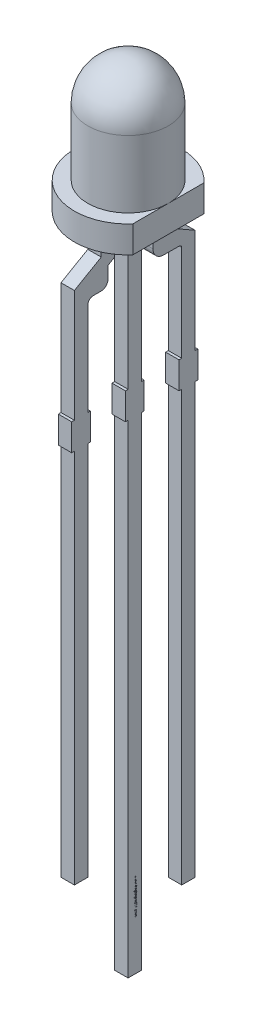
from build123d import *

# Parameters (mm, degrees)
EXTRUDE1_DEPTH     = 1
SKETCH2_3_W        = 0.5
SKETCH2_3_H        = 1
SKETCH2_3_W_2      = 0.1
SKETCH2_3_H_2      = 14
SKETCH2_3_H_3      = 18
SKETCH2_3_H_4      = 5.5
SKETCH2_3_H_5      = 16
EXTRUDE2_DEPTH     = 0.25
SKETCH3_W          = 0.058461538
SKETCH3_H          = 0.007179487
CUT_EXTRUDE1_DEPTH = 0.01


with BuildPart() as part:
    # Sketch1 → Extrude1 (new body)
    with BuildSketch(Plane(origin=(0, 0, 0), x_dir=(1, 0, 0), z_dir=(0, 1, 0))):
        with BuildLine():
            Line((1.5, -1.322875656), (1.5, 1.322875656))
            ThreePointArc((1.5, 1.322875656), (-2, 0), (1.5, -1.322875656))
        make_face()
    extrude(amount=EXTRUDE1_DEPTH)

    # Sketch2 → Revolve1 (revolve)
    with BuildSketch(Plane(origin=(0, 0, 0), x_dir=(0, 0, -1), z_dir=(1, 0, 0))):
        with BuildLine():
            ThreePointArc((0, 5), (1.060660172, 4.560660172), (1.5, 3.5))
            Line((1.5, 3.5), (1.5, 1))
            Line((1.5, 1), (0, 1))
            Line((0, 1), (0, 5))
        make_face()
    revolve(axis=Axis((0, 1, 0), (0, 1, 0)))

    # Sketch2<3> → Extrude2 (add, symmetric)
    with BuildSketch(Plane(origin=(0, 0, 0), x_dir=(0, 0, -1), z_dir=(1, 0, 0))):
        with Locations((-2, -6)):
            Rectangle(SKETCH2_3_W, SKETCH2_3_H)
        with BuildLine():
            Line((-0.75, 0), (-1.25, 0))
            Line((-1.25, 0), (-1.25, -0.733435773))
            Line((-1.25, -0.733435773), (-2.25, -1.310786042))
            Line((-2.25, -1.310786042), (-2.25, -5.5))
            Line((-2.25, -5.5), (-1.75, -5.5))
            Line((-1.75, -5.5), (-1.75, -2.03))
            ThreePointArc((-1.75, -2.03), (-1.691421356, -1.888578644), (-1.55, -1.83))
            Line((-1.55, -1.83), (-1.25, -1.83))
            ThreePointArc((-1.25, -1.83), (-1.073223305, -1.756776695), (-1, -1.58))
            Line((-1, -1.58), (-1, -1.127660605))
            Line((-1, -1.127660605), (-0.75, -0.983323038))
            Line((-0.75, -0.983323038), (-0.75, 0))
        make_face()
        with Locations((-1.7, -6)):
            Rectangle(SKETCH2_3_W_2, SKETCH2_3_H)
        with Locations((-2.3, -6)):
            Rectangle(SKETCH2_3_W_2, SKETCH2_3_H)
        with Locations((-2, -13.5)):
            Rectangle(SKETCH2_3_W, SKETCH2_3_H_2)
        with Locations((-0.3, -6)):
            Rectangle(SKETCH2_3_W_2, SKETCH2_3_H)
        with Locations((0.3, -6)):
            Rectangle(SKETCH2_3_W_2, SKETCH2_3_H)
        with Locations((0, -6)):
            Rectangle(SKETCH2_3_W, SKETCH2_3_H)
        with Locations((0, -15.5)):
            Rectangle(SKETCH2_3_W, SKETCH2_3_H_3)
        with Locations((0, -2.75)):
            Rectangle(SKETCH2_3_W, SKETCH2_3_H_4)
        with BuildLine():
            Line((1.177495486, -1), (1.177495486, 0))
            Line((1.177495486, 0), (0.677495486, 0))
            Line((0.677495486, 0), (0.677495486, -1.43))
            ThreePointArc((0.677495486, -1.43), (0.794652774, -1.712842712), (1.077495486, -1.83))
            Line((1.077495486, -1.83), (1.65, -1.83))
            ThreePointArc((1.65, -1.83), (1.720710678, -1.859289322), (1.75, -1.93))
            Line((1.75, -1.93), (1.75, -5.5))
            Line((1.75, -5.5), (2.25, -5.5))
            Line((2.25, -5.5), (2.25, -1.61921077))
            Line((2.25, -1.61921077), (1.177495486, -1))
        make_face()
        with Locations((1.7, -6)):
            Rectangle(SKETCH2_3_W_2, SKETCH2_3_H)
        with Locations((2, -6)):
            Rectangle(SKETCH2_3_W, SKETCH2_3_H)
        with Locations((2.3, -6)):
            Rectangle(SKETCH2_3_W_2, SKETCH2_3_H)
        with Locations((2, -14.5)):
            Rectangle(SKETCH2_3_W, SKETCH2_3_H_5)
    extrude(amount=EXTRUDE2_DEPTH, both=True)

    # Sketch3 → Cut-Extrude1 (cut)
    # profile 1 of 23: a face of its own
    with BuildSketch(Plane(origin=(0.25, 0, 0), x_dir=(0, 0, -1), z_dir=(1, 0, 0))):
        with BuildLine():
            Line((0.058461538, -22.571282051), (0.058461538, -22.578461538))
            Line((0.058461538, -22.578461538), (0.048301282, -22.578461538))
            add(Edge.make_bspline(
                [(0.048301282, -22.578461538), (0.049188826, -22.579109431), (0.050886565, -22.580348752), (0.053148699, -22.582361506), (0.055036904, -22.584406845), (0.056041095, -22.585869443), (0.056522436, -22.586570513)],
                knots=[0, 0, 0, 0, 1.134266299, 2.169680534, 3.122669868, 4, 4, 4, 4], degree=3))
            add(Edge.make_bspline(
                [(0.056522436, -22.586570513), (0.056979701, -22.587527419), (0.057886243, -22.589424514), (0.058805868, -22.592428382), (0.059371013, -22.595502089), (0.059448301, -22.597577705), (0.059487179, -22.598621795)],
                knots=[0, 0, 0, 0, 1.014936303, 2.012140481, 3.000054389, 4, 4, 4, 4], degree=3))
            add(Edge.make_bspline(
                [(0.059487179, -22.598621795), (0.059463224, -22.599327895), (0.059415817, -22.600725229), (0.059109084, -22.602796097), (0.058572496, -22.60480771), (0.05784404, -22.606747018), (0.056933659, -22.60856307), (0.055886826, -22.610231135), (0.054704364, -22.61173073), (0.053340487, -22.613059427), (0.051755591, -22.614254119), (0.049907283, -22.615353073), (0.04775396, -22.616368503), (0.046191297, -22.616931277), (0.04536859, -22.617227564)],
                knots=[0, 0, 0, 0, 1.009798505, 1.998336943, 2.985959917, 3.981996858, 4.955664737, 5.886087062, 6.794002107, 7.679958053, 8.601272429, 9.625787331, 10.750030247, 12, 12, 12, 12], degree=3))
            add(Edge.make_bspline(
                [(0.04536859, -22.617227564), (0.045933719, -22.617540964), (0.047045815, -22.618157691), (0.048619718, -22.619193249), (0.050091873, -22.620278227), (0.05146345, -22.621421872), (0.052727667, -22.62262015), (0.053888735, -22.62387869), (0.05495153, -22.625190366), (0.056193527, -22.627014073), (0.057507597, -22.629383404), (0.058661731, -22.632371499), (0.059360123, -22.635486039), (0.059444617, -22.637603334), (0.059487179, -22.638669872)],
                knots=[0, 0, 0, 0, 0.861170869, 1.694663331, 2.509326413, 3.297991968, 4.073691563, 4.829592376, 5.579160782, 6.321830913, 7.768780219, 9.179854006, 10.579417172, 12, 12, 12, 12], degree=3))
            add(Edge.make_bspline(
                [(0.059487179, -22.638669872), (0.059450214, -22.63965002), (0.05937787, -22.641568264), (0.058809791, -22.644360887), (0.057834302, -22.646965271), (0.056503247, -22.649376176), (0.05483058, -22.651551257), (0.052840435, -22.653441916), (0.05054689, -22.655036667), (0.048389358, -22.656078464), (0.046484551, -22.656785099), (0.04486155, -22.657220784), (0.043075229, -22.657605692), (0.041123451, -22.657925263), (0.038999323, -22.65815883), (0.03670632, -22.658331875), (0.034242661, -22.658448996), (0.032542878, -22.658457272), (0.031666667, -22.658461538)],
                knots=[0, 0, 0, 0, 1.209669288, 2.367440248, 3.500751976, 4.631527125, 5.755587489, 6.87532382, 8.007944318, 9.190864318, 9.82315674, 10.514484317, 11.263564316, 12.079023757, 12.955305781, 13.901327259, 14.918167583, 16, 16, 16, 16], degree=3))
            Line((0.031666667, -22.658461538), (0, -22.658461538))
            Line((0, -22.658461538), (0, -22.651282051))
            Line((0, -22.651282051), (0.031698718, -22.651282051))
            add(Edge.make_bspline(
                [(0.031698718, -22.651282051), (0.032446617, -22.651280271), (0.033883965, -22.65127685), (0.035946878, -22.651215281), (0.037827297, -22.651099274), (0.039522659, -22.650963625), (0.041036917, -22.650775195), (0.04236703, -22.65053186), (0.043523458, -22.650274083), (0.044805433, -22.649845836), (0.046219554, -22.649161285), (0.04774489, -22.648118712), (0.049071602, -22.646804687), (0.0502302, -22.645285785), (0.051153209, -22.643552216), (0.05183732, -22.641649606), (0.052241734, -22.63958437), (0.052285336, -22.638153515), (0.052307692, -22.637419872)],
                knots=[0, 0, 0, 0, 1.253542879, 2.409118771, 3.458568974, 4.411070626, 5.259544058, 6.014735414, 6.677123945, 7.243402448, 8.276608576, 9.299873988, 10.325604302, 11.392892819, 12.490509435, 13.603538441, 14.771260462, 16, 16, 16, 16], degree=3))
            add(Edge.make_bspline(
                [(0.052307692, -22.637419872), (0.052274618, -22.636513319), (0.052209061, -22.634716417), (0.051564592, -22.632097718), (0.05056881, -22.629588087), (0.049147096, -22.627254981), (0.047436454, -22.625106048), (0.045403515, -22.623256842), (0.043103349, -22.621729269), (0.040974295, -22.620694888), (0.039061849, -22.620041419), (0.037391052, -22.619609946), (0.035492045, -22.619274326), (0.033377588, -22.618959571), (0.031033127, -22.618754137), (0.028469506, -22.618567431), (0.025679016, -22.618480097), (0.023744691, -22.618467881), (0.022740385, -22.618461538)],
                knots=[0, 0, 0, 0, 1.090512009, 2.161531735, 3.230072964, 4.332825141, 5.440581378, 6.529496625, 7.62916386, 8.757669174, 9.370357692, 10.061947597, 10.834545503, 11.692923569, 12.636967211, 13.669242667, 14.789864225, 16, 16, 16, 16], degree=3))
            Line((0.022740385, -22.618461538), (0, -22.618461538))
            Line((0, -22.618461538), (0, -22.611282051))
            Line((0, -22.611282051), (0.029727564, -22.611282051))
            add(Edge.make_bspline(
                [(0.029727564, -22.611282051), (0.030566278, -22.611280317), (0.032179879, -22.611276981), (0.034493667, -22.611214736), (0.036598788, -22.61110199), (0.038489957, -22.610956368), (0.040172313, -22.610798319), (0.041640337, -22.610548202), (0.042900138, -22.61028748), (0.044295205, -22.609889594), (0.045808516, -22.609200424), (0.047434109, -22.608152122), (0.048866743, -22.606849839), (0.050081609, -22.605302581), (0.051077415, -22.603555419), (0.051805988, -22.601633184), (0.052226215, -22.599548021), (0.052280021, -22.598110884), (0.052307692, -22.597371795)],
                knots=[0, 0, 0, 0, 1.320226356, 2.539982809, 3.643122147, 4.638255983, 5.52602392, 6.301561104, 6.98107216, 7.550523949, 8.58191082, 9.584830316, 10.584890324, 11.614493144, 12.668965657, 13.738783174, 14.837104585, 16, 16, 16, 16], degree=3))
            add(Edge.make_bspline(
                [(0.052307692, -22.597371795), (0.05227271, -22.596502853), (0.052202993, -22.594771082), (0.051575466, -22.592227037), (0.050592516, -22.589770222), (0.049228863, -22.587439828), (0.047539741, -22.585298709), (0.045553117, -22.583424216), (0.0432937, -22.581848458), (0.041187118, -22.580802926), (0.039322507, -22.580129193), (0.037737623, -22.579679465), (0.035975572, -22.579302325), (0.034040209, -22.578982653), (0.031927518, -22.578742104), (0.029643469, -22.578598186), (0.027180849, -22.578471679), (0.025480963, -22.578465002), (0.024599359, -22.578461538)],
                knots=[0, 0, 0, 0, 1.098813768, 2.189896819, 3.297771711, 4.440532809, 5.596253211, 6.739894833, 7.8864334, 9.072265856, 9.705655743, 10.395080422, 11.156654178, 11.986235968, 12.878145268, 13.847797945, 14.883813667, 16, 16, 16, 16], degree=3))
            Line((0.024599359, -22.578461538), (0, -22.578461538))
            Line((0, -22.578461538), (0, -22.571282051))
            Line((0, -22.571282051), (0.058461538, -22.571282051))
        make_face()
    # profile 2 of 23: a face of its own
    with BuildSketch(Plane(origin=(0.25, 0, 0), x_dir=(0, 0, -1), z_dir=(1, 0, 0))):
        with BuildLine():
            add(Edge.make_bspline(
                [(0.059487179, -22.526698718), (0.059463891, -22.527795689), (0.059418227, -22.52994658), (0.058927771, -22.533096089), (0.058184026, -22.536099374), (0.057137109, -22.538969319), (0.055763513, -22.541682182), (0.054102426, -22.544262187), (0.052142611, -22.546704163), (0.050625727, -22.548167485), (0.049855769, -22.548910256)],
                knots=[0, 0, 0, 0, 1.054042676, 2.066720093, 3.05716247, 4.025731183, 4.997454851, 5.974904663, 6.97207755, 8, 8, 8, 8], degree=3))
            add(Edge.make_bspline(
                [(0.049855769, -22.548910256), (0.04911945, -22.549549844), (0.04766106, -22.550816641), (0.04529636, -22.552441), (0.042847444, -22.55384035), (0.040281791, -22.55496179), (0.037621798, -22.555846019), (0.034858324, -22.556473806), (0.03199747, -22.556847222), (0.030054525, -22.556897575), (0.029070513, -22.556923077)],
                knots=[0, 0, 0, 0, 1.025258237, 2.030674902, 3.01204498, 3.988269485, 4.97094183, 5.956517959, 6.965070386, 8, 8, 8, 8], degree=3))
            add(Edge.make_bspline(
                [(0.029070513, -22.556923077), (0.028080797, -22.556900646), (0.026125073, -22.556856323), (0.02324463, -22.55643704), (0.020451606, -22.555784901), (0.017757693, -22.554851601), (0.015154656, -22.553654845), (0.012653871, -22.552194485), (0.010250376, -22.550460284), (0.007964686, -22.548494449), (0.005857785, -22.546321945), (0.004022596, -22.543964603), (0.002443704, -22.54146704), (0.001189625, -22.538795162), (0.00017875, -22.535987001), (-0.000518314, -22.533024697), (-0.000943541, -22.529910891), (-0.00099789, -22.527784504), (-0.001025641, -22.526698718)],
                knots=[0, 0, 0, 0, 0.998669827, 1.973418153, 2.932281609, 3.89081133, 4.846438734, 5.82045571, 6.809776312, 7.834649874, 8.860672198, 9.859676908, 10.845817165, 11.837296335, 12.833502054, 13.853824644, 14.904110009, 16, 16, 16, 16], degree=3))
            add(Edge.make_bspline(
                [(-0.001025641, -22.526698718), (-0.00099766, -22.525607665), (-0.000942858, -22.523470781), (-0.000521477, -22.520345251), (0.000186198, -22.517370474), (0.00117711, -22.514549031), (0.002454005, -22.511877163), (0.004016452, -22.509370378), (0.005858714, -22.507011924), (0.007964434, -22.50483874), (0.010250441, -22.502873087), (0.012653854, -22.501138839), (0.01515466, -22.499678491), (0.017757692, -22.498481731), (0.020451606, -22.497548433), (0.02324463, -22.496896293), (0.026125073, -22.496477011), (0.028080797, -22.496432687), (0.029070513, -22.496410256)],
                knots=[0, 0, 0, 0, 1.099861214, 2.154133753, 3.1731438, 4.178222029, 5.163564916, 6.153006591, 7.15072618, 8.175428628, 9.198983792, 10.187031731, 11.15979573, 12.114193814, 13.071490482, 14.029120454, 15.002614863, 16, 16, 16, 16], degree=3))
            add(Edge.make_bspline(
                [(0.029070513, -22.496410256), (0.030049177, -22.496435932), (0.031986763, -22.496486765), (0.034842239, -22.496859806), (0.037601036, -22.497485144), (0.040250761, -22.498370433), (0.042805171, -22.499502209), (0.045260139, -22.500881896), (0.047614146, -22.502522824), (0.04907065, -22.503784583), (0.049807692, -22.504423077)],
                knots=[0, 0, 0, 0, 1.031353054, 2.041901799, 3.029428768, 4.008703097, 4.981709435, 5.96992636, 6.972712378, 8, 8, 8, 8], degree=3))
            add(Edge.make_bspline(
                [(0.049807692, -22.504423077), (0.050584198, -22.50516479), (0.052111333, -22.506623498), (0.054067282, -22.509076746), (0.055750764, -22.511645653), (0.057123669, -22.514376015), (0.058182127, -22.51725394), (0.058931242, -22.520279546), (0.059416057, -22.523440519), (0.059463236, -22.525601828), (0.059487179, -22.526698718)],
                knots=[0, 0, 0, 0, 1.027951202, 2.021646915, 2.998468564, 3.9668038, 4.943370589, 5.93035926, 6.949632805, 8, 8, 8, 8], degree=3))
        make_face()
        with BuildLine():
            add(Edge.make_bspline(
                [(0.052307692, -22.526666667), (0.052285643, -22.525890951), (0.052242114, -22.524359544), (0.051911071, -22.522105369), (0.051386493, -22.519935355), (0.050641492, -22.517845107), (0.049678346, -22.51584271), (0.048502032, -22.513925961), (0.047106284, -22.512100008), (0.045518845, -22.51037888), (0.043794607, -22.508780768), (0.041940524, -22.507399874), (0.040009787, -22.506223506), (0.037992374, -22.505244549), (0.035869178, -22.504515175), (0.03366389, -22.503985524), (0.031372114, -22.503654771), (0.029814147, -22.503611654), (0.029022436, -22.503589744)],
                knots=[0, 0, 0, 0, 1.021589593, 2.016807015, 2.994807536, 3.958602519, 4.934347097, 5.916793557, 6.916107818, 7.957073844, 8.998039869, 10.008589932, 10.997041759, 11.972786337, 12.956492182, 13.948170289, 14.957322718, 16, 16, 16, 16], degree=3))
            add(Edge.make_bspline(
                [(0.029022436, -22.503589744), (0.027999487, -22.503626374), (0.025969125, -22.503699079), (0.022979822, -22.504293309), (0.020104611, -22.505280354), (0.017378111, -22.506641422), (0.014851082, -22.508317619), (0.012578765, -22.510277587), (0.010648791, -22.512548424), (0.00902565, -22.515052804), (0.007747428, -22.517755235), (0.006830773, -22.520610412), (0.006242914, -22.523592336), (0.006183795, -22.525632921), (0.006153846, -22.526666667)],
                knots=[0, 0, 0, 0, 1.016977094, 2.018509362, 3.018404954, 4.033172147, 5.041280572, 6.028085189, 7.007940189, 7.995502847, 8.989109012, 9.972200833, 10.97273166, 12, 12, 12, 12], degree=3))
            add(Edge.make_bspline(
                [(0.006153846, -22.526666667), (0.006183622, -22.527700472), (0.006242398, -22.529741174), (0.006833751, -22.532727247), (0.007743442, -22.535590249), (0.009027094, -22.53829549), (0.010642656, -22.54080101), (0.01258976, -22.543055632), (0.014845109, -22.545032479), (0.017374761, -22.546710336), (0.020108849, -22.548049474), (0.022979292, -22.54904116), (0.02596926, -22.549633965), (0.027999532, -22.549706862), (0.029022436, -22.54974359)],
                knots=[0, 0, 0, 0, 1.027082318, 2.027431966, 3.015401697, 4.008827937, 4.996211763, 5.971861488, 6.96198607, 7.969911943, 8.982141629, 9.981856156, 10.983207064, 12, 12, 12, 12], degree=3))
            add(Edge.make_bspline(
                [(0.029022436, -22.54974359), (0.02981421, -22.549721842), (0.031372301, -22.549679047), (0.033663173, -22.54934596), (0.03587354, -22.548824536), (0.037983818, -22.548063223), (0.040019641, -22.547117865), (0.041934727, -22.54591288), (0.043795785, -22.544538417), (0.045517805, -22.542937373), (0.047112084, -22.541216439), (0.048496948, -22.539376769), (0.049679018, -22.537459129), (0.050641611, -22.535456099), (0.051383626, -22.533370581), (0.051913356, -22.531207156), (0.052240907, -22.528962964), (0.052285288, -22.527436995), (0.052307692, -22.526666667)],
                knots=[0, 0, 0, 0, 1.043020522, 2.052505155, 3.044509714, 4.030878336, 5.003918577, 5.996372628, 7.007255355, 8.048564058, 9.08987276, 10.095126797, 11.077896669, 12.053962454, 13.01807471, 13.98956039, 14.985105429, 16, 16, 16, 16], degree=3))
        make_face(mode=Mode.SUBTRACT)
    # profile 3 of 23: a face of its own
    with BuildSketch(Plane(origin=(0.25, 0, 0), x_dir=(0, 0, -1), z_dir=(1, 0, 0))):
        with BuildLine():
            Line((0.045785256, -22.484102564), (0.042051282, -22.478092949))
            add(Edge.make_bspline(
                [(0.042051282, -22.478092949), (0.042870286, -22.477434017), (0.044482357, -22.476137022), (0.046561593, -22.473884172), (0.048354692, -22.471482094), (0.049796421, -22.468885498), (0.050934517, -22.466117134), (0.051725478, -22.463171299), (0.052222642, -22.460048902), (0.052278878, -22.457907917), (0.052307692, -22.456810897)],
                knots=[0, 0, 0, 0, 1.026629843, 2.020746545, 2.988156479, 3.951609825, 4.916760838, 5.907688704, 6.927920211, 8, 8, 8, 8], degree=3))
            add(Edge.make_bspline(
                [(0.052307692, -22.456810897), (0.052283534, -22.455934122), (0.052235956, -22.454207338), (0.051938594, -22.451672325), (0.05139813, -22.449257696), (0.050686381, -22.446948001), (0.049731088, -22.444760814), (0.048575582, -22.442690006), (0.04721494, -22.440728652), (0.045658963, -22.438907909), (0.043949938, -22.437248576), (0.042145135, -22.435781034), (0.040231917, -22.434556175), (0.038246596, -22.433535158), (0.036155018, -22.432766963), (0.033982593, -22.432202051), (0.031715026, -22.431857715), (0.030172127, -22.431815993), (0.029391026, -22.431794872)],
                knots=[0, 0, 0, 0, 1.11253269, 2.191102883, 3.232049486, 4.248096668, 5.252846381, 6.25411548, 7.252444123, 8.276484619, 9.287796331, 10.271127345, 11.222403915, 12.165070373, 13.097940083, 14.043161362, 15.009338842, 16, 16, 16, 16], degree=3))
            add(Edge.make_bspline(
                [(0.029391026, -22.431794872), (0.028367685, -22.431835449), (0.026334791, -22.431916055), (0.023334812, -22.432550591), (0.02042883, -22.433582605), (0.017655686, -22.435022797), (0.015084484, -22.4368146), (0.012759609, -22.43890541), (0.010777858, -22.441341612), (0.009119285, -22.444051701), (0.007780598, -22.446986745), (0.006835969, -22.450123476), (0.006262607, -22.453435183), (0.006190573, -22.455702805), (0.006153846, -22.456858974)],
                knots=[0, 0, 0, 0, 0.966447457, 1.919872872, 2.884287729, 3.873230387, 4.863319139, 5.838939256, 6.818209587, 7.819967013, 8.834377336, 9.85802846, 10.90789553, 12, 12, 12, 12], degree=3))
            add(Edge.make_bspline(
                [(0.006153846, -22.456858974), (0.006183549, -22.457918521), (0.006241923, -22.460000813), (0.006734013, -22.463044636), (0.007539582, -22.465942463), (0.008662957, -22.468694189), (0.010115015, -22.471294787), (0.011906081, -22.473727454), (0.013984632, -22.476040596), (0.0155919, -22.477400526), (0.016410256, -22.478092949)],
                knots=[0, 0, 0, 0, 1.039848629, 2.043578496, 3.018386758, 3.987534228, 4.954977003, 5.934852016, 6.948509513, 8, 8, 8, 8], degree=3))
            Line((0.016410256, -22.478092949), (0.012467949, -22.484102564))
            add(Edge.make_bspline(
                [(0.012467949, -22.484102564), (0.011944736, -22.483746271), (0.010900048, -22.483034867), (0.009426976, -22.481845709), (0.008048435, -22.480562799), (0.006764837, -22.479192165), (0.005553665, -22.477751202), (0.004449244, -22.476202402), (0.003423628, -22.474572132), (0.00249419, -22.472852913), (0.001660564, -22.471061676), (0.000939138, -22.469198367), (0.000329175, -22.467271402), (-0.000164384, -22.465285112), (-0.000554848, -22.463236362), (-0.000814539, -22.461126713), (-0.001008212, -22.458956559), (-0.001019781, -22.457489769), (-0.001025641, -22.456746795)],
                knots=[0, 0, 0, 0, 0.954067324, 1.904967979, 2.850944488, 3.791040077, 4.734579251, 5.686741025, 6.656553487, 7.63677735, 8.631289747, 9.633371755, 10.647134148, 11.676547777, 12.717490898, 13.789379914, 14.88025357, 16, 16, 16, 16], degree=3))
            add(Edge.make_bspline(
                [(-0.001025641, -22.456746795), (-0.001005269, -22.455612832), (-0.000965339, -22.453390256), (-0.000526289, -22.45013717), (0.0001356, -22.447028286), (0.001085628, -22.444064666), (0.002308595, -22.441245852), (0.003802462, -22.438574455), (0.005579667, -22.43605939), (0.007608451, -22.433725262), (0.009808528, -22.431582303), (0.012181201, -22.429739499), (0.014647317, -22.428149674), (0.017235595, -22.426838568), (0.019955829, -22.425848146), (0.022786723, -22.425143265), (0.025728213, -22.424694489), (0.027733417, -22.424641997), (0.02875, -22.424615385)],
                knots=[0, 0, 0, 0, 1.112900083, 2.181292239, 3.217426397, 4.231060065, 5.231907716, 6.230057215, 7.231385915, 8.250448267, 9.26326716, 10.242335464, 11.195469137, 12.140906363, 13.085222324, 14.031808558, 15.002181388, 16, 16, 16, 16], degree=3))
            add(Edge.make_bspline(
                [(0.02875, -22.424615385), (0.029439682, -22.424626078), (0.030811575, -22.42464735), (0.032850522, -22.424868382), (0.034853356, -22.425199437), (0.036817204, -22.425669427), (0.038748004, -22.426259187), (0.040635447, -22.427000403), (0.042490513, -22.427867836), (0.044290362, -22.42887703), (0.046024095, -22.429990238), (0.04768184, -22.431199918), (0.04922114, -22.432526872), (0.050680521, -22.433943025), (0.052016409, -22.435469835), (0.053286521, -22.437078856), (0.054425053, -22.438809795), (0.055488212, -22.440618536), (0.056433185, -22.442507416), (0.057247763, -22.444463141), (0.057943794, -22.446474433), (0.058494863, -22.448544373), (0.058956973, -22.450659259), (0.059247667, -22.452835746), (0.059453068, -22.455065511), (0.059475714, -22.456575363), (0.059487179, -22.457339744)],
                knots=[0, 0, 0, 0, 0.991083503, 1.971428668, 2.944771278, 3.907728914, 4.872032831, 5.84458753, 6.820199395, 7.813689706, 8.808455339, 9.780676499, 10.761021664, 11.727616056, 12.70141294, 13.675300653, 14.672050164, 15.67696011, 16.690052069, 17.705469636, 18.720567748, 19.746988726, 20.783187267, 21.830086354, 22.901455311, 24, 24, 24, 24], degree=3))
            add(Edge.make_bspline(
                [(0.059487179, -22.457339744), (0.059466113, -22.458297006), (0.059424086, -22.460206746), (0.059070205, -22.463039636), (0.058537114, -22.465830991), (0.057745717, -22.468530938), (0.056794693, -22.471105442), (0.055706123, -22.473510689), (0.054472691, -22.475708966), (0.053101548, -22.477720695), (0.051562778, -22.479553863), (0.049829803, -22.481228118), (0.047913104, -22.482778592), (0.046500393, -22.483657598), (0.045785256, -22.484102564)],
                knots=[0, 0, 0, 0, 1.095247575, 2.185020588, 3.262981163, 4.344680461, 5.40090428, 6.402280576, 7.363136638, 8.282296962, 9.184898179, 10.097200524, 11.036773704, 12, 12, 12, 12], degree=3))
        make_face()
    # profile 4 of 23: a face of its own
    with BuildSketch(Plane(origin=(0.25, 0, 0), x_dir=(0, 0, -1), z_dir=(1, 0, 0))):
        with BuildLine():
            add(Edge.make_bspline(
                [(0.012307692, -22.403589744), (0.012282095, -22.404035542), (0.012232209, -22.404904341), (0.011865571, -22.406162388), (0.011246947, -22.407312015), (0.010396951, -22.408329713), (0.009382172, -22.409175551), (0.008235465, -22.409801293), (0.006973771, -22.410184737), (0.00609244, -22.410232134), (0.005641026, -22.41025641)],
                knots=[0, 0, 0, 0, 1.020591893, 1.988988293, 2.974634352, 3.991697318, 5.008760285, 5.983632262, 6.967224335, 8, 8, 8, 8], degree=3))
            add(Edge.make_bspline(
                [(0.005641026, -22.41025641), (0.005200466, -22.410231164), (0.004330188, -22.410181293), (0.003078041, -22.409802089), (0.001930571, -22.409170652), (0.000901997, -22.408335487), (5.0182e-05, -22.407311768), (-0.000562926, -22.406159608), (-0.000955219, -22.404907357), (-0.001001787, -22.40403605), (-0.001025641, -22.403589744)],
                knots=[0, 0, 0, 0, 1.009852967, 1.994853009, 2.971120474, 3.99910934, 5.017628188, 6.004685157, 6.977947174, 8, 8, 8, 8], degree=3))
            add(Edge.make_bspline(
                [(-0.001025641, -22.403589744), (-0.001000892, -22.403143759), (-0.000952291, -22.402267957), (-0.00057076, -22.401011014), (5.6059e-05, -22.399865829), (0.000900422, -22.39884191), (0.0019359, -22.398013682), (0.003070229, -22.397353155), (0.004333805, -22.397004295), (0.005201178, -22.396950405), (0.005641026, -22.396923077)],
                knots=[0, 0, 0, 0, 1.021616397, 2.006195831, 2.982046417, 4.000130345, 5.027680246, 6.00943514, 6.990578253, 8, 8, 8, 8], degree=3))
            add(Edge.make_bspline(
                [(0.005641026, -22.396923077), (0.006091702, -22.396949509), (0.006970095, -22.397001027), (0.008243274, -22.397353964), (0.009376895, -22.398008692), (0.01039851, -22.398847697), (0.011241088, -22.399865577), (0.011873286, -22.401008312), (0.012229324, -22.402270921), (0.01228122, -22.403144253), (0.012307692, -22.403589744)],
                knots=[0, 0, 0, 0, 1.032329927, 2.012066096, 2.992413168, 4.009037178, 5.025661188, 6.000112418, 6.979848586, 8, 8, 8, 8], degree=3))
        make_face()
    # profile 5 of 23: a face of its own
    with BuildSketch(Plane(origin=(0.25, 0, 0), x_dir=(0, 0, -1), z_dir=(1, 0, 0))):
        Polygon((0.08, -22.348717949), (0, -22.385641026), (0, -22.377836538), (0.025641026, -22.366009615), (0.025641026, -22.32974359), (0, -22.317580128), (0, -22.30974359), (0.08, -22.347692308), align=None)
        Polygon((0.064407051, -22.348125), (0.033846154, -22.333637821), (0.033846154, -22.362227564), align=None, mode=Mode.SUBTRACT)
    # profile 6 of 23: a face of its own
    with BuildSketch(Plane(origin=(0.25, 0, 0), x_dir=(0, 0, -1), z_dir=(1, 0, 0))):
        with BuildLine():
            Line((0.015432692, -22.252307692), (0.019487179, -22.259070513))
            add(Edge.make_bspline(
                [(0.019487179, -22.259070513), (0.018434279, -22.259699501), (0.016416963, -22.260904618), (0.013691065, -22.262914935), (0.011374216, -22.264997973), (0.009479893, -22.267169158), (0.00798849, -22.269415237), (0.006932439, -22.271750872), (0.006273788, -22.274168194), (0.006193786, -22.27581331), (0.006153846, -22.276634615)],
                knots=[0, 0, 0, 0, 1.272034388, 2.437168799, 3.508375237, 4.49857839, 5.41946034, 6.295179144, 7.148887113, 8, 8, 8, 8], degree=3))
            add(Edge.make_bspline(
                [(0.006153846, -22.276634615), (0.006173382, -22.277336029), (0.00621211, -22.278726584), (0.006584243, -22.28077372), (0.007155948, -22.28276188), (0.007974717, -22.284650062), (0.008965293, -22.286412302), (0.010161841, -22.287957408), (0.011501183, -22.289293994), (0.012996474, -22.290384319), (0.014599054, -22.291230746), (0.016258743, -22.291843244), (0.017968238, -22.292233062), (0.019127224, -22.292282678), (0.019711538, -22.292307692)],
                knots=[0, 0, 0, 0, 1.095270387, 2.171376115, 3.241375676, 4.322296363, 5.380636668, 6.392615365, 7.366724986, 8.328592944, 9.273498763, 10.190095884, 11.087518669, 12, 12, 12, 12], degree=3))
            add(Edge.make_bspline(
                [(0.019711538, -22.292307692), (0.020377615, -22.292273994), (0.021731651, -22.29220549), (0.023729358, -22.291626484), (0.025706331, -22.290715644), (0.026929217, -22.289875355), (0.027564103, -22.289439103)],
                knots=[0, 0, 0, 0, 0.938893495, 1.908633276, 2.914225137, 4, 4, 4, 4], degree=3))
            add(Edge.make_bspline(
                [(0.027564103, -22.289439103), (0.028023252, -22.289081931), (0.028990009, -22.288329893), (0.030404992, -22.287019112), (0.031900211, -22.285521015), (0.033469595, -22.283828114), (0.035084485, -22.281906758), (0.036778541, -22.279796398), (0.038546672, -22.27748611), (0.039715921, -22.275857924), (0.040320513, -22.275016026)],
                knots=[0, 0, 0, 0, 0.72226686, 1.520759855, 2.393439377, 3.351307446, 4.386958158, 5.510256019, 6.712608938, 8, 8, 8, 8], degree=3))
            add(Edge.make_bspline(
                [(0.040320513, -22.275016026), (0.040920161, -22.274174447), (0.042066642, -22.272565411), (0.043765994, -22.270313478), (0.045329586, -22.268302454), (0.046735637, -22.266522092), (0.048045473, -22.265018452), (0.049188893, -22.263736565), (0.050226954, -22.262723725), (0.050899822, -22.262160103), (0.051201923, -22.261907051)],
                knots=[0, 0, 0, 0, 1.452255772, 2.776602448, 3.96446981, 5.032613149, 5.964194703, 6.766668629, 7.446264616, 8, 8, 8, 8], degree=3))
            add(Edge.make_bspline(
                [(0.051201923, -22.261907051), (0.051672804, -22.261553393), (0.052598854, -22.260857877), (0.05404628, -22.259939797), (0.055527954, -22.259159473), (0.05704786, -22.258547763), (0.058584658, -22.258032649), (0.060158401, -22.257686182), (0.061762026, -22.257469236), (0.062841192, -22.257447019), (0.06338141, -22.257435897)],
                knots=[0, 0, 0, 0, 1.068054152, 2.10047183, 3.106115577, 4.101338837, 5.06977816, 6.043150881, 7.020423561, 8, 8, 8, 8], degree=3))
            add(Edge.make_bspline(
                [(0.06338141, -22.257435897), (0.064227876, -22.257465601), (0.065902715, -22.257524372), (0.068348106, -22.258025472), (0.070689926, -22.258807155), (0.072876592, -22.259937697), (0.07490299, -22.261335466), (0.076738162, -22.262987409), (0.078294069, -22.264948727), (0.07963773, -22.267112672), (0.080698606, -22.269465991), (0.081503123, -22.271927568), (0.081952897, -22.274508197), (0.082018165, -22.276259045), (0.082051282, -22.277147436)],
                knots=[0, 0, 0, 0, 1.005541892, 1.989591032, 2.955705311, 3.932863626, 4.905387107, 5.876519979, 6.856563935, 7.871847665, 8.897921447, 9.918317993, 10.943742853, 12, 12, 12, 12], degree=3))
            add(Edge.make_bspline(
                [(0.082051282, -22.277147436), (0.082019376, -22.278090299), (0.081956102, -22.279960108), (0.08138625, -22.282715675), (0.080465759, -22.285373819), (0.079405576, -22.287513494), (0.078351453, -22.289185199), (0.077390931, -22.290459983), (0.076285235, -22.291751817), (0.075031303, -22.293071085), (0.073617665, -22.294395443), (0.072053992, -22.29574455), (0.070349842, -22.297121562), (0.069133282, -22.298007411), (0.068509615, -22.298461538)],
                knots=[0, 0, 0, 0, 1.286821612, 2.551921131, 3.825787379, 5.12137259, 5.803616487, 6.523126609, 7.299589446, 8.125436757, 9.008162487, 9.944516264, 10.946261234, 12, 12, 12, 12], degree=3))
            Line((0.068509615, -22.298461538), (0.063589744, -22.291971154))
            add(Edge.make_bspline(
                [(0.063589744, -22.291971154), (0.064094628, -22.291579247), (0.065066917, -22.290824526), (0.066428547, -22.289678709), (0.067672353, -22.28859874), (0.068752697, -22.28753473), (0.069728752, -22.286542878), (0.070564381, -22.285580195), (0.071267896, -22.284660576), (0.072018302, -22.283501236), (0.072766887, -22.282040994), (0.073386844, -22.280209777), (0.07377281, -22.278301318), (0.073821437, -22.277005039), (0.073846154, -22.276346154)],
                knots=[0, 0, 0, 0, 1.181667846, 2.275615987, 3.290305621, 4.226321945, 5.078535498, 5.862783384, 6.581873284, 7.217493746, 8.414623899, 9.604724551, 10.782505457, 12, 12, 12, 12], degree=3))
            add(Edge.make_bspline(
                [(0.073846154, -22.276346154), (0.073818458, -22.275519719), (0.073765049, -22.273926017), (0.073181735, -22.271663383), (0.072263292, -22.269626951), (0.070976093, -22.267877178), (0.069451041, -22.266420333), (0.067696096, -22.265366494), (0.065758213, -22.264732204), (0.064406403, -22.264654804), (0.063717949, -22.264615385)],
                knots=[0, 0, 0, 0, 1.14458467, 2.207223713, 3.21896685, 4.227309161, 5.202851033, 6.127160689, 7.046193047, 8, 8, 8, 8], degree=3))
            add(Edge.make_bspline(
                [(0.063717949, -22.264615385), (0.063289453, -22.264624789), (0.06243176, -22.264643612), (0.061161254, -22.264888432), (0.059902026, -22.26523558), (0.058648476, -22.265743651), (0.057371115, -22.266428001), (0.05607339, -22.26735851), (0.054722537, -22.268522616), (0.053844819, -22.269416092), (0.05338141, -22.269887821)],
                knots=[0, 0, 0, 0, 0.858526328, 1.718456515, 2.587092892, 3.476767204, 4.426280253, 5.487868114, 6.673670035, 8, 8, 8, 8], degree=3))
            add(Edge.make_bspline(
                [(0.05338141, -22.269887821), (0.053225135, -22.270062938), (0.052853862, -22.270478976), (0.052246038, -22.271239568), (0.051496261, -22.272243975), (0.050568551, -22.273465968), (0.049492403, -22.274928079), (0.048281578, -22.276630469), (0.046896767, -22.278554161), (0.045928595, -22.279919234), (0.045416667, -22.280641026)],
                knots=[0, 0, 0, 0, 0.420754252, 0.999615792, 1.744751191, 2.668019286, 3.750313428, 4.999500688, 6.413464383, 8, 8, 8, 8], degree=3))
            add(Edge.make_bspline(
                [(0.045416667, -22.280641026), (0.044784864, -22.281509275), (0.043561466, -22.28319052), (0.041723393, -22.285582693), (0.03992573, -22.287751694), (0.038179956, -22.289705139), (0.036499314, -22.291462326), (0.034863584, -22.293003759), (0.033284486, -22.294345146), (0.03125997, -22.295789243), (0.028773545, -22.29726485), (0.025727185, -22.298532084), (0.022668983, -22.299331132), (0.020613513, -22.299435624), (0.019599359, -22.299487179)],
                knots=[0, 0, 0, 0, 1.163667725, 2.253281268, 3.268753668, 4.215851969, 5.092017293, 5.902905408, 6.650798638, 7.335211899, 8.59617414, 9.77448103, 10.901945474, 12, 12, 12, 12], degree=3))
            add(Edge.make_bspline(
                [(0.019599359, -22.299487179), (0.018882145, -22.299472151), (0.017461644, -22.299442385), (0.015375732, -22.299100543), (0.013350189, -22.298599071), (0.011408219, -22.297845624), (0.009523835, -22.296918813), (0.007714396, -22.295774069), (0.006004776, -22.294394081), (0.004359397, -22.292860279), (0.002873147, -22.291155716), (0.001543863, -22.289358418), (0.000431261, -22.287456715), (-0.000464387, -22.285459814), (-0.001175983, -22.283378759), (-0.001687464, -22.281211361), (-0.002002101, -22.278951585), (-0.002034705, -22.277415561), (-0.002051282, -22.276634615)],
                knots=[0, 0, 0, 0, 0.983610584, 1.948120116, 2.894308362, 3.843560551, 4.801159957, 5.773581695, 6.77566113, 7.813174769, 8.857584665, 9.875476876, 10.877851407, 11.875574773, 12.875048225, 13.892438445, 14.928473903, 16, 16, 16, 16], degree=3))
            add(Edge.make_bspline(
                [(-0.002051282, -22.276634615), (-0.002039464, -22.276030406), (-0.002015977, -22.274829596), (-0.001813254, -22.27305822), (-0.001515958, -22.271319372), (-0.00106269, -22.269634885), (-0.000499802, -22.267983784), (0.000189372, -22.266380787), (0.001009798, -22.264821999), (0.001962837, -22.2633056), (0.003061179, -22.261817301), (0.004330475, -22.260364732), (0.005761955, -22.258931275), (0.007370301, -22.257543209), (0.009138328, -22.256174947), (0.011080851, -22.254851935), (0.013187787, -22.253547232), (0.014670414, -22.252728589), (0.015432692, -22.252307692)],
                knots=[0, 0, 0, 0, 0.915384692, 1.819241058, 2.699029451, 3.586605375, 4.459625921, 5.340865773, 6.228072412, 7.126546901, 8.052715223, 9.028303326, 10.047266019, 11.120332924, 12.245748783, 13.433636234, 14.680528497, 16, 16, 16, 16], degree=3))
        make_face()
    # profile 7 of 23: a face of its own
    with BuildSketch(Plane(origin=(0.25, 0, 0), x_dir=(0, 0, -1), z_dir=(1, 0, 0))):
        with BuildLine():
            Line((0.08, -22.187692308), (0.08, -22.194871795))
            Line((0.08, -22.194871795), (0.032067308, -22.194871795))
            add(Edge.make_bspline(
                [(0.032067308, -22.194871795), (0.031388891, -22.194870726), (0.030101478, -22.194868699), (0.02826906, -22.194882242), (0.026639975, -22.19492017), (0.025207944, -22.194944083), (0.023979539, -22.194997279), (0.022948103, -22.195040663), (0.022118521, -22.195096447), (0.021634386, -22.19516349), (0.021426282, -22.195192308)],
                knots=[0, 0, 0, 0, 1.528628734, 2.90083645, 4.128790002, 5.200304208, 6.127813768, 6.898992206, 7.526736466, 8, 8, 8, 8], degree=3))
            add(Edge.make_bspline(
                [(0.021426282, -22.195192308), (0.020675434, -22.195310535), (0.019216045, -22.195540327), (0.017139031, -22.196128102), (0.01526072, -22.196942369), (0.013543651, -22.197933786), (0.012013352, -22.199208771), (0.010592614, -22.200726257), (0.009365197, -22.202581945), (0.008235979, -22.204644013), (0.007329683, -22.206867963), (0.006644033, -22.209140146), (0.006226252, -22.211426862), (0.006177871, -22.212957743), (0.006153846, -22.213717949)],
                knots=[0, 0, 0, 0, 1.035924841, 2.013479024, 2.933602255, 3.82183108, 4.706948133, 5.639927629, 6.646101806, 7.731477349, 8.84205456, 9.913728764, 10.963998332, 12, 12, 12, 12], degree=3))
            add(Edge.make_bspline(
                [(0.006153846, -22.213717949), (0.00617839, -22.214370607), (0.006227336, -22.215672153), (0.006530474, -22.217605997), (0.007076696, -22.219489495), (0.007781897, -22.221331541), (0.008712187, -22.223059367), (0.009794267, -22.224671736), (0.011044995, -22.226126168), (0.012448883, -22.227437794), (0.014018429, -22.228586183), (0.015748904, -22.229555127), (0.017634619, -22.230371761), (0.018964319, -22.230771965), (0.019647436, -22.230977564)],
                knots=[0, 0, 0, 0, 0.994510594, 1.983277156, 2.972612928, 3.9776239, 4.982470102, 5.955333794, 6.930747147, 7.898149105, 8.876444039, 9.885893618, 10.913904934, 12, 12, 12, 12], degree=3))
            add(Edge.make_bspline(
                [(0.019647436, -22.230977564), (0.019929689, -22.231046138), (0.020558663, -22.23119895), (0.021622007, -22.231341739), (0.022876621, -22.23149046), (0.024331519, -22.23159365), (0.025981827, -22.231694249), (0.027836142, -22.231754434), (0.029887729, -22.231782252), (0.031319436, -22.231790541), (0.032067308, -22.231794872)],
                knots=[0, 0, 0, 0, 0.558680831, 1.244966039, 2.062412453, 2.990489873, 4.051219941, 5.244515665, 6.560634259, 8, 8, 8, 8], degree=3))
            Line((0.032067308, -22.231794872), (0.08, -22.231794872))
            Line((0.08, -22.231794872), (0.08, -22.238974359))
            Line((0.08, -22.238974359), (0.031682692, -22.238974359))
            add(Edge.make_bspline(
                [(0.031682692, -22.238974359), (0.030811863, -22.238968615), (0.029112386, -22.238957404), (0.0266222, -22.238858214), (0.024259386, -22.238704632), (0.02202696, -22.238472449), (0.019922263, -22.238216127), (0.017948371, -22.237849383), (0.016092047, -22.237465992), (0.01435647, -22.236981048), (0.012718677, -22.236396045), (0.01113547, -22.235711117), (0.00961979, -22.23487301), (0.008149747, -22.233916616), (0.006723327, -22.232854758), (0.005374029, -22.231630836), (0.004057615, -22.230308217), (0.002817526, -22.228859041), (0.001672172, -22.227309207), (0.000686938, -22.22565596), (-0.000178153, -22.223932591), (-0.000861492, -22.222120641), (-0.001390399, -22.220231913), (-0.001779638, -22.218266504), (-0.002001694, -22.21621773), (-0.002034613, -22.214824235), (-0.002051282, -22.21411859)],
                knots=[0, 0, 0, 0, 1.316364231, 2.568964831, 3.766826305, 4.894964518, 5.961692026, 6.970710131, 7.928946231, 8.826316495, 9.692177228, 10.556379512, 11.43093279, 12.306715499, 13.20629939, 14.115652445, 15.057829886, 16.025681089, 16.996391533, 17.967202739, 18.931442607, 19.907779629, 20.889445314, 21.893507297, 22.933303057, 24, 24, 24, 24], degree=3))
            add(Edge.make_bspline(
                [(-0.002051282, -22.21411859), (-0.002033345, -22.21334901), (-0.001998151, -22.211839098), (-0.001796488, -22.209614228), (-0.001416639, -22.207481332), (-0.000932984, -22.205417883), (-0.000265927, -22.203451975), (0.000513459, -22.201557268), (0.001470654, -22.199766212), (0.002535645, -22.198049752), (0.003733923, -22.196453758), (0.005039984, -22.194988674), (0.006432907, -22.193652083), (0.007927772, -22.192466512), (0.009512954, -22.191412321), (0.011192937, -22.190504202), (0.01296707, -22.18972447), (0.014200286, -22.189322035), (0.014823718, -22.18911859)],
                knots=[0, 0, 0, 0, 1.13879206, 2.234305948, 3.301075583, 4.341971843, 5.366689343, 6.369221514, 7.369726634, 8.367512178, 9.355451585, 10.318319045, 11.268648973, 12.207971039, 13.137398894, 14.081662264, 15.030215811, 16, 16, 16, 16], degree=3))
            add(Edge.make_bspline(
                [(0.014823718, -22.18911859), (0.015249605, -22.189000255), (0.016173365, -22.188743583), (0.017702199, -22.188468719), (0.01946254, -22.188237655), (0.021454508, -22.188020385), (0.023679648, -22.18789218), (0.026136995, -22.187779781), (0.028829519, -22.187691516), (0.030705051, -22.187692036), (0.031682692, -22.187692308)],
                knots=[0, 0, 0, 0, 0.625038921, 1.35572334, 2.194682327, 3.136881307, 4.189498639, 5.346923369, 6.617055217, 8, 8, 8, 8], degree=3))
            Line((0.031682692, -22.187692308), (0.08, -22.187692308))
        make_face()
    # profile 8 of 23: a face of its own
    with BuildSketch(Plane(origin=(0.25, 0, 0), x_dir=(0, 0, -1), z_dir=(1, 0, 0))):
        Polygon((0.082051282, -22.154871795), (0.082051282, -22.162051282), (0.058461538, -22.162051282), (0.058461538, -22.172307692), (0.051282051, -22.172307692), (0.051282051, -22.162051282), (0, -22.162051282), (0, -22.154871795), (0.051282051, -22.154871795), (0.051282051, -22.144615385), (0.058461538, -22.144615385), (0.058461538, -22.154871795), align=None)
    # profile 9 of 23: a face of its own
    with BuildSketch(Plane(origin=(0.25, 0, 0), x_dir=(0, 0, -1), z_dir=(1, 0, 0))):
        with BuildLine():
            Line((0.082051282, -22.08), (0.082051282, -22.087179487))
            Line((0.082051282, -22.087179487), (0.047419872, -22.087179487))
            add(Edge.make_bspline(
                [(0.047419872, -22.087179487), (0.048381931, -22.087951325), (0.050252138, -22.089451748), (0.05271692, -22.091961194), (0.054821089, -22.094569408), (0.056516819, -22.097320265), (0.057845172, -22.100175553), (0.058800588, -22.10315014), (0.059375135, -22.106249202), (0.059449567, -22.108357641), (0.059487179, -22.109423077)],
                knots=[0, 0, 0, 0, 1.125719942, 2.188356526, 3.205611246, 4.180516366, 5.132291467, 6.075069812, 7.02729502, 8, 8, 8, 8], degree=3))
            add(Edge.make_bspline(
                [(0.059487179, -22.109423077), (0.059447225, -22.110504885), (0.059369023, -22.112622245), (0.058752411, -22.115705662), (0.057692679, -22.118587675), (0.056257113, -22.12126369), (0.0544595, -22.123662873), (0.052372791, -22.125768891), (0.049972998, -22.127503619), (0.04774916, -22.128682175), (0.045771252, -22.12944969), (0.044074389, -22.129935417), (0.042183611, -22.130347293), (0.040099843, -22.130706142), (0.037813097, -22.13094531), (0.035333685, -22.131137415), (0.032661751, -22.13127402), (0.030812146, -22.131279314), (0.029855769, -22.131282051)],
                knots=[0, 0, 0, 0, 1.23557613, 2.418320525, 3.575024647, 4.733016537, 5.875704003, 6.989294038, 8.107658508, 9.246262776, 9.854990416, 10.529125826, 11.260725398, 12.065539328, 12.943870397, 13.886749146, 14.907300446, 16, 16, 16, 16], degree=3))
            Line((0.029855769, -22.131282051), (0, -22.131282051))
            Line((0, -22.131282051), (0, -22.124102564))
            Line((0, -22.124102564), (0.0275, -22.124102564))
            add(Edge.make_bspline(
                [(0.0275, -22.124102564), (0.028295947, -22.124098214), (0.029818457, -22.124089894), (0.031998254, -22.124062389), (0.033975309, -22.12400099), (0.035743285, -22.123901771), (0.037304647, -22.123797421), (0.038657128, -22.123653802), (0.039802586, -22.123486711), (0.040492063, -22.123336568), (0.040801282, -22.123269231)],
                knots=[0, 0, 0, 0, 1.430932559, 2.737130458, 3.918967929, 4.986496826, 5.920444988, 6.731744033, 7.431208747, 8, 8, 8, 8], degree=3))
            add(Edge.make_bspline(
                [(0.040801282, -22.123269231), (0.041708583, -22.123008106), (0.043452864, -22.122506096), (0.045822243, -22.121339269), (0.047842631, -22.119881978), (0.04948579, -22.118102401), (0.050780112, -22.116029039), (0.0516626, -22.113651462), (0.052225191, -22.110998392), (0.052279373, -22.10913238), (0.052307692, -22.108157051)],
                knots=[0, 0, 0, 0, 1.090097712, 2.095706502, 3.037208793, 3.95517211, 4.879102211, 5.845071496, 6.873660557, 8, 8, 8, 8], degree=3))
            add(Edge.make_bspline(
                [(0.052307692, -22.108157051), (0.052296816, -22.107579502), (0.052275293, -22.106436547), (0.052059204, -22.104741721), (0.05170609, -22.103097628), (0.051228272, -22.101488435), (0.050578088, -22.099948248), (0.049825398, -22.098432172), (0.048904067, -22.096983161), (0.047870335, -22.095575486), (0.046725883, -22.094265371), (0.045517953, -22.093046465), (0.044231668, -22.091959874), (0.042887665, -22.090975449), (0.04146751, -22.09012566), (0.039984897, -22.089383875), (0.038437877, -22.088754488), (0.037364161, -22.088441741), (0.036826923, -22.088285256)],
                knots=[0, 0, 0, 0, 1.024319606, 2.027102035, 3.025350316, 4.005802111, 5.00026367, 5.987881639, 7.005602596, 8.042517216, 9.083927026, 10.089214625, 11.084353441, 12.06828073, 13.041928858, 14.016821737, 15.00770877, 16, 16, 16, 16], degree=3))
            add(Edge.make_bspline(
                [(0.036826923, -22.088285256), (0.036437873, -22.088195212), (0.035590084, -22.087998995), (0.034191814, -22.087786085), (0.032566983, -22.087595507), (0.030718055, -22.087434397), (0.028638255, -22.087335583), (0.026341776, -22.087229109), (0.023814232, -22.087189475), (0.022056621, -22.087182916), (0.021137821, -22.087179487)],
                knots=[0, 0, 0, 0, 0.607992626, 1.324890765, 2.152360218, 3.099583803, 4.150613268, 5.323148443, 6.60066238, 8, 8, 8, 8], degree=3))
            Line((0.021137821, -22.087179487), (0, -22.087179487))
            Line((0, -22.087179487), (0, -22.08))
            Line((0, -22.08), (0.082051282, -22.08))
        make_face()
    # profile 10 of 23: a face of its own
    with BuildSketch(Plane(origin=(0.25, 0, 0), x_dir=(0, 0, -1), z_dir=(1, 0, 0))):
        with BuildLine():
            Line((0.058461538, -22.056410256), (0.058461538, -22.063589744))
            Line((0.058461538, -22.063589744), (0.012067308, -22.063589744))
            add(Edge.make_bspline(
                [(0.012067308, -22.063589744), (0.01107902, -22.063583411), (0.009171386, -22.063571188), (0.006413025, -22.063483166), (0.003865229, -22.06329755), (0.001516378, -22.063087066), (-0.000622642, -22.062784284), (-0.002558212, -22.062414539), (-0.004292191, -22.061997723), (-0.005360187, -22.061631547), (-0.005865385, -22.061458333)],
                knots=[0, 0, 0, 0, 1.307562039, 2.523909702, 3.650326591, 4.686913197, 5.643429486, 6.506965704, 7.293745905, 8, 8, 8, 8], degree=3))
            add(Edge.make_bspline(
                [(-0.005865385, -22.061458333), (-0.006522091, -22.061202604), (-0.00781587, -22.060698792), (-0.009649469, -22.059754765), (-0.01137746, -22.058699307), (-0.012980098, -22.057489564), (-0.014482598, -22.056156141), (-0.015858724, -22.05467455), (-0.017129833, -22.053071138), (-0.018270777, -22.051332855), (-0.019270546, -22.04947731), (-0.020155451, -22.047529184), (-0.020919713, -22.045494107), (-0.021493352, -22.043352504), (-0.021990057, -22.041136907), (-0.022313389, -22.03882155), (-0.022533429, -22.036419883), (-0.022553779, -22.034786846), (-0.022564103, -22.033958333)],
                knots=[0, 0, 0, 0, 0.981884813, 1.934411902, 2.870642727, 3.801527012, 4.729816098, 5.667674509, 6.616731011, 7.579249157, 8.562291171, 9.552107921, 10.560574871, 11.588648803, 12.640348669, 13.724070705, 14.845319185, 16, 16, 16, 16], degree=3))
            add(Edge.make_bspline(
                [(-0.022564103, -22.033958333), (-0.022544569, -22.032749527), (-0.022506415, -22.030388405), (-0.022060303, -22.026946172), (-0.021433617, -22.023681225), (-0.020475092, -22.020634881), (-0.019306971, -22.017818912), (-0.017976503, -22.015245956), (-0.016435559, -22.01295833), (-0.014687625, -22.010898013), (-0.012608274, -22.009038874), (-0.010158069, -22.007289649), (-0.007299381, -22.005605979), (-0.005201264, -22.004619266), (-0.004102564, -22.004102564)],
                knots=[0, 0, 0, 0, 1.157931887, 2.261752077, 3.322178827, 4.340878186, 5.316509817, 6.24181319, 7.112369066, 7.954886437, 8.824930176, 9.778504873, 10.836691706, 12, 12, 12, 12], degree=3))
            Line((-0.004102564, -22.004102564), (-0.004102564, -22.011282051))
            add(Edge.make_bspline(
                [(-0.004102564, -22.011282051), (-0.00501927, -22.011859473), (-0.006811317, -22.012988262), (-0.009131617, -22.015099084), (-0.011114551, -22.017412372), (-0.012712512, -22.020006193), (-0.013917307, -22.022891341), (-0.014776171, -22.026069551), (-0.015290372, -22.029566685), (-0.015352344, -22.032001387), (-0.015384615, -22.033269231)],
                knots=[0, 0, 0, 0, 0.997731894, 1.950442991, 2.880492273, 3.800895997, 4.748200782, 5.754801363, 6.83083817, 8, 8, 8, 8], degree=3))
            add(Edge.make_bspline(
                [(-0.015384615, -22.033269231), (-0.015352075, -22.034521078), (-0.01528934, -22.036934514), (-0.014773631, -22.040409614), (-0.013919464, -22.043583807), (-0.012719091, -22.046433252), (-0.011236547, -22.048914904), (-0.00959629, -22.051061678), (-0.007740078, -22.05280174), (-0.006030927, -22.053972411), (-0.00450807, -22.054700047), (-0.003197158, -22.055163415), (-0.001714805, -22.055539962), (-6.5989e-05, -22.05585493), (0.001751649, -22.056114837), (0.003742264, -22.056279474), (0.005901332, -22.056398464), (0.007398318, -22.056406235), (0.008173077, -22.056410256)],
                knots=[0, 0, 0, 0, 1.570672572, 3.028099501, 4.397683431, 5.686589315, 6.895122698, 8.017723291, 9.066023084, 10.075791025, 10.603605416, 11.180458235, 11.81795017, 12.521450677, 13.286658401, 14.121327423, 15.027701111, 16, 16, 16, 16], degree=3))
            Line((0.008173077, -22.056410256), (0.011201923, -22.056410256))
            add(Edge.make_bspline(
                [(0.011201923, -22.056410256), (0.010334682, -22.055681545), (0.008615454, -22.05423694), (0.006362617, -22.051742144), (0.004422362, -22.049017186), (0.002831079, -22.046066705), (0.001558361, -22.042962974), (0.000668236, -22.039739609), (9.3153e-05, -22.036425505), (3.1271e-05, -22.034179741), (0, -22.033044872)],
                knots=[0, 0, 0, 0, 1.012485704, 2.007162095, 2.997754123, 3.998611389, 4.999708251, 5.992315798, 6.98544096, 8, 8, 8, 8], degree=3))
            add(Edge.make_bspline(
                [(0, -22.033044872), (1.1772e-05, -22.032376614), (3.5177e-05, -22.031048007), (0.000239949, -22.029074184), (0.000537063, -22.027129489), (0.00097321, -22.025218455), (0.001533021, -22.023338327), (0.002232832, -22.021492211), (0.003024035, -22.019665159), (0.003955985, -22.017890382), (0.004992836, -22.016185554), (0.006116017, -22.014563548), (0.007319613, -22.013032803), (0.008615623, -22.0116081), (0.010001695, -22.010290527), (0.011464815, -22.009065267), (0.013016491, -22.007943396), (0.014657327, -22.006939455), (0.016347318, -22.006022254), (0.018094559, -22.005236965), (0.019887997, -22.004585073), (0.021705209, -22.004010557), (0.023579335, -22.003603728), (0.025488162, -22.003292643), (0.027443335, -22.003118104), (0.028760368, -22.003090708), (0.029423077, -22.003076923)],
                knots=[0, 0, 0, 0, 1.028796061, 2.045417375, 3.052978994, 4.056772505, 5.061374657, 6.071351207, 7.095367434, 8.125609542, 9.155490328, 10.16637099, 11.162041966, 12.151987513, 13.129482149, 14.104793677, 15.088808581, 16.075021637, 17.065069715, 18.0481558, 19.021557435, 20.00254184, 20.980451754, 21.971763498, 22.979425854, 24, 24, 24, 24], degree=3))
            add(Edge.make_bspline(
                [(0.029423077, -22.003076923), (0.030086008, -22.003088781), (0.031409303, -22.003112452), (0.033372213, -22.003317169), (0.035309061, -22.003608554), (0.037198834, -22.004072155), (0.039068812, -22.00462225), (0.040888551, -22.005335701), (0.042682134, -22.006157687), (0.044433832, -22.007097178), (0.046127528, -22.008148837), (0.047728536, -22.009306431), (0.049250171, -22.01054576), (0.050672917, -22.011891764), (0.052007438, -22.013336487), (0.053242024, -22.014884129), (0.05439899, -22.016517477), (0.055452943, -22.018242124), (0.056385114, -22.020031315), (0.057235687, -22.021839633), (0.057910753, -22.023691021), (0.058505566, -22.025550965), (0.058926942, -22.02745222), (0.059252022, -22.029371474), (0.059450073, -22.031315299), (0.059474795, -22.03261708), (0.059487179, -22.033269231)],
                knots=[0, 0, 0, 0, 1.008914434, 2.013921196, 3.001938835, 3.98818112, 4.973517748, 5.967241793, 6.960633033, 7.975722852, 8.991170928, 9.993245185, 10.981396684, 11.976616977, 12.972235889, 13.973022409, 14.988340224, 16.01763096, 17.047082309, 18.058647952, 19.057085865, 20.044802253, 21.029198803, 22.0185208, 23.007341325, 24, 24, 24, 24], degree=3))
            add(Edge.make_bspline(
                [(0.059487179, -22.033269231), (0.059456653, -22.034344768), (0.059396523, -22.036463337), (0.058910065, -22.039587335), (0.058151868, -22.042605112), (0.057049685, -22.045532129), (0.055558127, -22.048386251), (0.05356821, -22.051150302), (0.051119238, -22.053871599), (0.049222329, -22.055542489), (0.048237179, -22.056410256)],
                knots=[0, 0, 0, 0, 0.967343326, 1.905452219, 2.838102277, 3.762990896, 4.713322225, 5.726933809, 6.819495538, 8, 8, 8, 8], degree=3))
            Line((0.048237179, -22.056410256), (0.058461538, -22.056410256))
        make_face()
        with BuildLine():
            add(Edge.make_bspline(
                [(0.052307692, -22.033846154), (0.052272011, -22.032796309), (0.05220137, -22.030717838), (0.051598286, -22.027671254), (0.050653254, -22.024730042), (0.049301357, -22.021950583), (0.047653732, -22.019346648), (0.045656497, -22.017037621), (0.043382118, -22.015014234), (0.04082958, -22.013323832), (0.038088354, -22.011965561), (0.035202649, -22.010978061), (0.032205715, -22.010361031), (0.030163181, -22.01029145), (0.029134615, -22.01025641)],
                knots=[0, 0, 0, 0, 1.026331696, 2.03191913, 3.02692423, 4.041490544, 5.047661868, 6.033509946, 7.018359977, 8.017132933, 9.01989117, 10.003339456, 10.994534818, 12, 12, 12, 12], degree=3))
            add(Edge.make_bspline(
                [(0.029134615, -22.01025641), (0.028358993, -22.010272991), (0.026833571, -22.010305602), (0.024595057, -22.010619391), (0.022462693, -22.011125992), (0.020437776, -22.011845974), (0.018500905, -22.012732235), (0.016687892, -22.013873771), (0.014965472, -22.015187563), (0.013369043, -22.016694556), (0.011912872, -22.018352584), (0.010640053, -22.020149809), (0.009584727, -22.022076388), (0.008686177, -22.024101537), (0.008025163, -22.02626813), (0.007521677, -22.028543681), (0.007233406, -22.030943451), (0.007197695, -22.032579382), (0.007179487, -22.033413462)],
                knots=[0, 0, 0, 0, 1.039892369, 2.045164194, 3.025377528, 3.974939947, 4.923826224, 5.876304068, 6.842270891, 7.825700405, 8.815919897, 9.798017152, 10.773083594, 11.758208475, 12.764450271, 13.80592145, 14.881349344, 16, 16, 16, 16], degree=3))
            add(Edge.make_bspline(
                [(0.007179487, -22.033413462), (0.007197033, -22.034258347), (0.007231342, -22.035910513), (0.007526279, -22.038323563), (0.00800221, -22.040610026), (0.008677937, -22.042767804), (0.009540147, -22.044805049), (0.010631274, -22.046698857), (0.011873872, -22.048489904), (0.013323357, -22.050120751), (0.014920478, -22.051596171), (0.016659568, -22.052879301), (0.018507063, -22.053981306), (0.020486518, -22.05485839), (0.022571776, -22.055581882), (0.024797999, -22.056037999), (0.027132421, -22.056365128), (0.028732739, -22.056394985), (0.029551282, -22.056410256)],
                knots=[0, 0, 0, 0, 1.121992135, 2.194043731, 3.223932285, 4.220423016, 5.193184374, 6.156086365, 7.118779155, 8.084057622, 9.048292205, 10.002025119, 10.950065319, 11.899697616, 12.87359713, 13.875731462, 14.913461982, 16, 16, 16, 16], degree=3))
            add(Edge.make_bspline(
                [(0.029551282, -22.056410256), (0.030616833, -22.056379638), (0.032698545, -22.05631982), (0.035731842, -22.055755313), (0.038583699, -22.054845137), (0.041245089, -22.053568639), (0.043687833, -22.051969054), (0.045866622, -22.050042393), (0.047784515, -22.047821962), (0.049381572, -22.045313835), (0.050676716, -22.042611755), (0.051635565, -22.039785582), (0.052191352, -22.036843288), (0.052268621, -22.034852709), (0.052307692, -22.033846154)],
                knots=[0, 0, 0, 0, 1.070930318, 2.092221514, 3.091405799, 4.074392322, 5.052047932, 6.019043127, 6.99061078, 7.993717296, 9.000730765, 9.998165278, 10.987753177, 12, 12, 12, 12], degree=3))
        make_face(mode=Mode.SUBTRACT)
    # profile 11 of 23: a face of its own
    with BuildSketch(Plane(origin=(0.25, 0, 0), x_dir=(0, 0, -1), z_dir=(1, 0, 0))):
        with BuildLine():
            add(Edge.make_bspline(
                [(0.083076923, -21.985096154), (0.083056167, -21.985541595), (0.083015523, -21.986413855), (0.082670248, -21.987676472), (0.082076059, -21.988825016), (0.081304787, -21.989858949), (0.080360442, -21.990716033), (0.079287456, -21.991330607), (0.078119345, -21.99172295), (0.077305429, -21.991770607), (0.076891026, -21.991794872)],
                knots=[0, 0, 0, 0, 1.054986045, 2.065865298, 3.074122704, 4.105114675, 5.109626121, 6.074217918, 7.019490725, 8, 8, 8, 8], degree=3))
            add(Edge.make_bspline(
                [(0.076891026, -21.991794872), (0.076487378, -21.991770064), (0.075689416, -21.991721023), (0.074541558, -21.991330897), (0.073483514, -21.99071088), (0.072541014, -21.98985952), (0.071770188, -21.988824865), (0.071175881, -21.987676512), (0.070830637, -21.986413845), (0.070789989, -21.985541592), (0.070769231, -21.985096154)],
                knots=[0, 0, 0, 0, 0.961106377, 1.899993565, 2.859409042, 3.870007927, 4.90724781, 5.921615355, 6.938620636, 8, 8, 8, 8], degree=3))
            add(Edge.make_bspline(
                [(0.070769231, -21.985096154), (0.070789322, -21.984655832), (0.070828428, -21.983798803), (0.071180012, -21.982559402), (0.071768896, -21.981429338), (0.072551681, -21.980412313), (0.073477247, -21.979544074), (0.074542357, -21.978926344), (0.075689212, -21.978535176), (0.07648731, -21.978486275), (0.076891026, -21.978461538)],
                knots=[0, 0, 0, 0, 1.055304112, 2.054011575, 3.063363921, 4.096942562, 5.122536081, 6.088009498, 7.032825006, 8, 8, 8, 8], degree=3))
            add(Edge.make_bspline(
                [(0.076891026, -21.978461538), (0.0773055, -21.978485729), (0.078119555, -21.978533242), (0.079286643, -21.978926648), (0.080366762, -21.979538858), (0.081294128, -21.980412874), (0.082077349, -21.981429191), (0.082666119, -21.98255944), (0.083017732, -21.983798793), (0.083056834, -21.984655828), (0.083076923, -21.985096154)],
                knots=[0, 0, 0, 0, 0.986662878, 1.937868148, 2.908513651, 3.927890639, 4.955204348, 5.958438607, 6.951092507, 8, 8, 8, 8], degree=3))
        make_face()
    # profile 12 of 23: a face of its own
    with BuildSketch(Plane(origin=(0.25, 0, 0), x_dir=(0, 0, -1), z_dir=(1, 0, 0))):
        with Locations((0.029230769, -21.985128206)):
            Rectangle(SKETCH3_W, SKETCH3_H)
    # profile 13 of 23: a face of its own
    with BuildSketch(Plane(origin=(0.25, 0, 0), x_dir=(0, 0, -1), z_dir=(1, 0, 0))):
        with BuildLine():
            Line((0.058461538, -21.946666667), (0.058461538, -21.953846154))
            Line((0.058461538, -21.953846154), (0.049855769, -21.953846154))
            add(Edge.make_bspline(
                [(0.049855769, -21.953846154), (0.050657129, -21.954376119), (0.052189724, -21.955389673), (0.054215363, -21.957075366), (0.055900017, -21.958801504), (0.057227235, -21.960589554), (0.058229345, -21.962424568), (0.058969525, -21.964276033), (0.059399774, -21.966182302), (0.059458005, -21.96746589), (0.059487179, -21.968108974)],
                knots=[0, 0, 0, 0, 1.280622107, 2.44917983, 3.507334186, 4.490567186, 5.408878616, 6.288712897, 7.142636019, 8, 8, 8, 8], degree=3))
            add(Edge.make_bspline(
                [(0.059487179, -21.968108974), (0.059460576, -21.968608023), (0.059406115, -21.969629652), (0.059004323, -21.971180877), (0.058387181, -21.972785705), (0.057792632, -21.973821332), (0.057483974, -21.974358974)],
                knots=[0, 0, 0, 0, 0.90119973, 1.844890732, 2.881183062, 4, 4, 4, 4], degree=3))
            Line((0.057483974, -21.974358974), (0.051266026, -21.970416667))
            add(Edge.make_bspline(
                [(0.051266026, -21.970416667), (0.051420089, -21.970071318), (0.05171253, -21.969415779), (0.052058633, -21.968456817), (0.052262426, -21.967572673), (0.052293299, -21.967009391), (0.052307692, -21.966746795)],
                knots=[0, 0, 0, 0, 1.180555205, 2.24091978, 3.179933427, 4, 4, 4, 4], degree=3))
            add(Edge.make_bspline(
                [(0.052307692, -21.966746795), (0.052270703, -21.966164874), (0.052195931, -21.964988527), (0.05156621, -21.96326395), (0.050591574, -21.961582902), (0.049472194, -21.960264845), (0.048413454, -21.959236475), (0.047483853, -21.958502215), (0.046442197, -21.957828217), (0.045305477, -21.957184358), (0.044054521, -21.95659769), (0.042701759, -21.956050158), (0.041245642, -21.955555097), (0.040231185, -21.955272806), (0.039711538, -21.955128205)],
                knots=[0, 0, 0, 0, 1.135927944, 2.296268816, 3.551388088, 4.924624343, 5.663947748, 6.437790805, 7.238014523, 8.089896346, 8.992356783, 9.939655789, 10.944608424, 12, 12, 12, 12], degree=3))
            add(Edge.make_bspline(
                [(0.039711538, -21.955128205), (0.03924806, -21.955020036), (0.038221491, -21.95478045), (0.036499239, -21.954547501), (0.034464413, -21.95431734), (0.032111348, -21.954155132), (0.02944592, -21.954004777), (0.02646407, -21.953919975), (0.023162736, -21.953849046), (0.020854751, -21.953847147), (0.019647436, -21.953846154)],
                knots=[0, 0, 0, 0, 0.566838948, 1.255505196, 2.06880316, 3.007127437, 4.065329342, 5.249902469, 6.561414163, 8, 8, 8, 8], degree=3))
            Line((0.019647436, -21.953846154), (0, -21.953846154))
            Line((0, -21.953846154), (0, -21.946666667))
            Line((0, -21.946666667), (0.058461538, -21.946666667))
        make_face()
    # profile 14 of 23: a face of its own
    with BuildSketch(Plane(origin=(0.25, 0, 0), x_dir=(0, 0, -1), z_dir=(1, 0, 0))):
        with BuildLine():
            Line((0, -21.872820513), (0.082051282, -21.872820513))
            Line((0.082051282, -21.872820513), (0.082051282, -21.88))
            Line((0.082051282, -21.88), (0.047852564, -21.88))
            add(Edge.make_bspline(
                [(0.047852564, -21.88), (0.048786084, -21.88080187), (0.050613022, -21.882371165), (0.052963215, -21.885032828), (0.054999715, -21.887795738), (0.056637036, -21.890727929), (0.057918664, -21.893803682), (0.058828894, -21.897019718), (0.059394767, -21.900385986), (0.059456018, -21.902679371), (0.059487179, -21.903846154)],
                knots=[0, 0, 0, 0, 1.073845349, 2.101561798, 3.093746447, 4.06731023, 5.027507813, 5.99794647, 6.981435071, 8, 8, 8, 8], degree=3))
            add(Edge.make_bspline(
                [(0.059487179, -21.903846154), (0.059458895, -21.904878547), (0.059402973, -21.906919764), (0.058976117, -21.909920149), (0.058289994, -21.912803682), (0.057320781, -21.915570988), (0.056063261, -21.918220572), (0.05453649, -21.920761698), (0.052726265, -21.923182199), (0.050655116, -21.92544603), (0.048407312, -21.927533394), (0.046002171, -21.929357743), (0.043482643, -21.930907439), (0.040832157, -21.932154082), (0.038083283, -21.933171294), (0.035196662, -21.933843287), (0.032198022, -21.934277375), (0.030156468, -21.934331472), (0.02911859, -21.934358974)],
                knots=[0, 0, 0, 0, 1.034424137, 2.045232812, 3.030843571, 4.001080581, 4.978206309, 5.965255608, 6.967506581, 8.002193933, 9.036548792, 10.037741014, 11.022988172, 11.995276286, 12.96911093, 13.954721688, 14.960227752, 16, 16, 16, 16], degree=3))
            add(Edge.make_bspline(
                [(0.02911859, -21.934358974), (0.028096875, -21.934330713), (0.026082215, -21.934274986), (0.023117493, -21.933849356), (0.020264037, -21.933146584), (0.01752922, -21.932141757), (0.014900193, -21.930878558), (0.012406927, -21.929298872), (0.010006036, -21.927474621), (0.007774639, -21.925364194), (0.005712161, -21.923080456), (0.003920027, -21.920636702), (0.002372207, -21.918094487), (0.001145797, -21.915414187), (0.000153776, -21.912635489), (-0.000534628, -21.909728623), (-0.000936298, -21.906710035), (-0.000995626, -21.904659317), (-0.001025641, -21.903621795)],
                knots=[0, 0, 0, 0, 1.024244038, 2.01964794, 2.996620209, 3.965911562, 4.936179293, 5.91563013, 6.920572822, 7.955171681, 8.990768464, 10.002129126, 10.989675881, 11.969873457, 12.952483066, 13.943799762, 14.959703725, 16, 16, 16, 16], degree=3))
            add(Edge.make_bspline(
                [(-0.001025641, -21.903621795), (-0.000992763, -21.902434002), (-0.000928296, -21.900104948), (-0.000392292, -21.896698293), (0.000514884, -21.893477384), (0.001746117, -21.890406008), (0.003404816, -21.887518591), (0.005450832, -21.884786695), (0.007945596, -21.882255876), (0.009843671, -21.880764842), (0.010817308, -21.88)],
                knots=[0, 0, 0, 0, 1.035884751, 2.031189381, 2.999123778, 3.950239786, 4.910390163, 5.895605504, 6.920529319, 8, 8, 8, 8], degree=3))
            Line((0.010817308, -21.88), (0, -21.88))
            Line((0, -21.88), (0, -21.872820513))
        make_face()
        with BuildLine():
            add(Edge.make_bspline(
                [(0.006153846, -21.903557692), (0.006191187, -21.904607163), (0.006264891, -21.90667865), (0.006840282, -21.90971966), (0.007797655, -21.912629665), (0.009106914, -21.915394207), (0.010753439, -21.917969255), (0.012744218, -21.92027166), (0.015025042, -21.922312247), (0.017574985, -21.924043833), (0.020320341, -21.925441754), (0.023186412, -21.926426444), (0.026124395, -21.927081124), (0.028116176, -21.927146557), (0.02911859, -21.927179487)],
                knots=[0, 0, 0, 0, 1.031861621, 2.036730714, 3.032102247, 4.038124785, 5.038035477, 6.029195352, 7.02284546, 8.040167683, 9.05302878, 10.043491941, 11.015338596, 12, 12, 12, 12], degree=3))
            add(Edge.make_bspline(
                [(0.02911859, -21.927179487), (0.030120222, -21.927136735), (0.032119489, -21.927051401), (0.035079128, -21.926442975), (0.037955947, -21.925414262), (0.040727673, -21.924014749), (0.043301062, -21.922261853), (0.045626355, -21.920230039), (0.04762686, -21.917900095), (0.049295438, -21.915321603), (0.050656737, -21.91257454), (0.051590354, -21.909683348), (0.052201508, -21.906708299), (0.052272118, -21.904687832), (0.052307692, -21.903669872)],
                knots=[0, 0, 0, 0, 0.984698701, 1.96546623, 2.957354799, 3.98164001, 5.010280354, 6.011473015, 7.009725998, 8.019440419, 9.024964737, 10.015029379, 10.999924227, 12, 12, 12, 12], degree=3))
            add(Edge.make_bspline(
                [(0.052307692, -21.903669872), (0.052272137, -21.902630616), (0.052201566, -21.900567904), (0.051589294, -21.897524036), (0.050650983, -21.89455125), (0.049304285, -21.891710054), (0.047654905, -21.889063202), (0.045724276, -21.88669328), (0.04350081, -21.884669513), (0.041027858, -21.882984849), (0.03834456, -21.88165692), (0.035494216, -21.880676019), (0.032468908, -21.880111041), (0.030397614, -21.880037464), (0.029342949, -21.88)],
                knots=[0, 0, 0, 0, 1.0169775, 2.018493981, 3.029491472, 4.064042901, 5.08895728, 6.077764832, 7.048099865, 8.023317454, 8.999054219, 9.971953187, 10.967355531, 12, 12, 12, 12], degree=3))
            add(Edge.make_bspline(
                [(0.029342949, -21.88), (0.028535227, -21.880021935), (0.026945375, -21.88006511), (0.024611032, -21.880394952), (0.022377116, -21.880919635), (0.02024129, -21.881658981), (0.018215322, -21.882630192), (0.016284815, -21.883801638), (0.014459244, -21.885193501), (0.012765909, -21.886784966), (0.011217201, -21.888519793), (0.009857429, -21.890372691), (0.008720927, -21.892331768), (0.007784068, -21.894387917), (0.00703724, -21.896536503), (0.006539327, -21.89879647), (0.006197352, -21.901143399), (0.006168501, -21.902744455), (0.006153846, -21.903557692)],
                knots=[0, 0, 0, 0, 1.050410851, 2.067540964, 3.060285716, 4.031641603, 5.001405429, 5.977447716, 6.964216063, 7.981915705, 8.995836261, 9.985438752, 10.966317358, 11.93650433, 12.920994585, 13.918930257, 14.942944538, 16, 16, 16, 16], degree=3))
        make_face(mode=Mode.SUBTRACT)
    # profile 15 of 23: a face of its own
    with BuildSketch(Plane(origin=(0.25, 0, 0), x_dir=(0, 0, -1), z_dir=(1, 0, 0))):
        with BuildLine():
            Line((0.058461538, -21.849230769), (0.058461538, -21.856410256))
            Line((0.058461538, -21.856410256), (0.012067308, -21.856410256))
            add(Edge.make_bspline(
                [(0.012067308, -21.856410256), (0.01107902, -21.856403924), (0.009171386, -21.856391701), (0.006413025, -21.856303679), (0.003865229, -21.856118063), (0.001516378, -21.855907579), (-0.000622642, -21.855604797), (-0.002558212, -21.855235051), (-0.004292191, -21.854818236), (-0.005360187, -21.85445206), (-0.005865385, -21.854278846)],
                knots=[0, 0, 0, 0, 1.307562039, 2.523909702, 3.650326591, 4.686913197, 5.643429486, 6.506965704, 7.293745905, 8, 8, 8, 8], degree=3))
            add(Edge.make_bspline(
                [(-0.005865385, -21.854278846), (-0.006522091, -21.854023117), (-0.00781587, -21.853519305), (-0.009649469, -21.852575277), (-0.01137746, -21.85151982), (-0.012980098, -21.850310077), (-0.014482598, -21.848976653), (-0.015858724, -21.847495063), (-0.017129833, -21.845891651), (-0.018270777, -21.844153367), (-0.019270546, -21.842297823), (-0.020155451, -21.840349697), (-0.020919713, -21.838314619), (-0.021493352, -21.836173017), (-0.021990057, -21.833957419), (-0.022313389, -21.831642063), (-0.022533429, -21.829240396), (-0.022553779, -21.827607359), (-0.022564103, -21.826778846)],
                knots=[0, 0, 0, 0, 0.981884813, 1.934411902, 2.870642727, 3.801527012, 4.729816098, 5.667674509, 6.616731011, 7.579249157, 8.562291171, 9.552107921, 10.560574871, 11.588648803, 12.640348669, 13.724070705, 14.845319185, 16, 16, 16, 16], degree=3))
            add(Edge.make_bspline(
                [(-0.022564103, -21.826778846), (-0.022544569, -21.82557004), (-0.022506415, -21.823208917), (-0.022060303, -21.819766685), (-0.021433617, -21.816501738), (-0.020475092, -21.813455394), (-0.019306971, -21.810639425), (-0.017976503, -21.808066469), (-0.016435559, -21.805778843), (-0.014687625, -21.803718526), (-0.012608274, -21.801859386), (-0.010158069, -21.800110162), (-0.007299381, -21.798426492), (-0.005201264, -21.797439779), (-0.004102564, -21.796923077)],
                knots=[0, 0, 0, 0, 1.157931887, 2.261752077, 3.322178827, 4.340878186, 5.316509817, 6.24181319, 7.112369066, 7.954886437, 8.824930176, 9.778504873, 10.836691706, 12, 12, 12, 12], degree=3))
            Line((-0.004102564, -21.796923077), (-0.004102564, -21.804102564))
            add(Edge.make_bspline(
                [(-0.004102564, -21.804102564), (-0.00501927, -21.804679986), (-0.006811317, -21.805808775), (-0.009131617, -21.807919597), (-0.011114551, -21.810232885), (-0.012712512, -21.812826706), (-0.013917307, -21.815711854), (-0.014776171, -21.818890064), (-0.015290372, -21.822387198), (-0.015352344, -21.8248219), (-0.015384615, -21.826089744)],
                knots=[0, 0, 0, 0, 0.997731894, 1.950442991, 2.880492273, 3.800895997, 4.748200782, 5.754801363, 6.83083817, 8, 8, 8, 8], degree=3))
            add(Edge.make_bspline(
                [(-0.015384615, -21.826089744), (-0.015352075, -21.827341591), (-0.01528934, -21.829755027), (-0.014773631, -21.833230127), (-0.013919464, -21.83640432), (-0.012719091, -21.839253765), (-0.011236547, -21.841735416), (-0.00959629, -21.843882191), (-0.007740078, -21.845622253), (-0.006030927, -21.846792924), (-0.00450807, -21.84752056), (-0.003197158, -21.847983928), (-0.001714805, -21.848360475), (-6.5989e-05, -21.848675443), (0.001751649, -21.848935349), (0.003742264, -21.849099987), (0.005901332, -21.849218977), (0.007398318, -21.849226748), (0.008173077, -21.849230769)],
                knots=[0, 0, 0, 0, 1.570672572, 3.028099501, 4.397683431, 5.686589315, 6.895122698, 8.017723291, 9.066023084, 10.075791025, 10.603605416, 11.180458235, 11.81795017, 12.521450677, 13.286658401, 14.121327423, 15.027701111, 16, 16, 16, 16], degree=3))
            Line((0.008173077, -21.849230769), (0.011201923, -21.849230769))
            add(Edge.make_bspline(
                [(0.011201923, -21.849230769), (0.010334682, -21.848502058), (0.008615454, -21.847057453), (0.006362617, -21.844562657), (0.004422362, -21.841837699), (0.002831079, -21.838887218), (0.001558361, -21.835783487), (0.000668236, -21.832560122), (9.3153e-05, -21.829246018), (3.1271e-05, -21.827000254), (0, -21.825865385)],
                knots=[0, 0, 0, 0, 1.012485704, 2.007162095, 2.997754123, 3.998611389, 4.999708251, 5.992315798, 6.98544096, 8, 8, 8, 8], degree=3))
            add(Edge.make_bspline(
                [(0, -21.825865385), (1.1772e-05, -21.825197127), (3.5177e-05, -21.82386852), (0.000239949, -21.821894697), (0.000537063, -21.819950001), (0.00097321, -21.818038968), (0.001533021, -21.81615884), (0.002232832, -21.814312724), (0.003024035, -21.812485671), (0.003955985, -21.810710895), (0.004992836, -21.809006066), (0.006116017, -21.807384061), (0.007319613, -21.805853315), (0.008615623, -21.804428613), (0.010001695, -21.80311104), (0.011464815, -21.80188578), (0.013016491, -21.800763909), (0.014657327, -21.799759967), (0.016347318, -21.798842767), (0.018094559, -21.798057478), (0.019887997, -21.797405586), (0.021705209, -21.796831069), (0.023579335, -21.796424241), (0.025488162, -21.796113155), (0.027443335, -21.795938617), (0.028760368, -21.795911221), (0.029423077, -21.795897436)],
                knots=[0, 0, 0, 0, 1.028796061, 2.045417375, 3.052978994, 4.056772505, 5.061374657, 6.071351207, 7.095367434, 8.125609542, 9.155490328, 10.16637099, 11.162041966, 12.151987513, 13.129482149, 14.104793677, 15.088808581, 16.075021637, 17.065069715, 18.0481558, 19.021557435, 20.00254184, 20.980451754, 21.971763498, 22.979425854, 24, 24, 24, 24], degree=3))
            add(Edge.make_bspline(
                [(0.029423077, -21.795897436), (0.030086008, -21.795909294), (0.031409303, -21.795932965), (0.033372213, -21.796137682), (0.035309061, -21.796429066), (0.037198834, -21.796892668), (0.039068812, -21.797442763), (0.040888551, -21.798156214), (0.042682134, -21.7989782), (0.044433832, -21.799917691), (0.046127528, -21.80096935), (0.047728536, -21.802126944), (0.049250171, -21.803366272), (0.050672917, -21.804712276), (0.052007438, -21.806157), (0.053242024, -21.807704642), (0.05439899, -21.80933799), (0.055452943, -21.811062637), (0.056385114, -21.812851828), (0.057235687, -21.814660146), (0.057910753, -21.816511533), (0.058505566, -21.818371477), (0.058926942, -21.820272733), (0.059252022, -21.822191987), (0.059450073, -21.824135812), (0.059474795, -21.825437593), (0.059487179, -21.826089744)],
                knots=[0, 0, 0, 0, 1.008914434, 2.013921196, 3.001938835, 3.98818112, 4.973517748, 5.967241793, 6.960633033, 7.975722852, 8.991170928, 9.993245185, 10.981396684, 11.976616977, 12.972235889, 13.973022409, 14.988340224, 16.01763096, 17.047082309, 18.058647952, 19.057085865, 20.044802253, 21.029198803, 22.0185208, 23.007341325, 24, 24, 24, 24], degree=3))
            add(Edge.make_bspline(
                [(0.059487179, -21.826089744), (0.059456653, -21.82716528), (0.059396523, -21.82928385), (0.058910065, -21.832407848), (0.058151868, -21.835425625), (0.057049685, -21.838352642), (0.055558127, -21.841206764), (0.05356821, -21.843970814), (0.051119238, -21.846692111), (0.049222329, -21.848363002), (0.048237179, -21.849230769)],
                knots=[0, 0, 0, 0, 0.967343326, 1.905452219, 2.838102277, 3.762990896, 4.713322225, 5.726933809, 6.819495538, 8, 8, 8, 8], degree=3))
            Line((0.048237179, -21.849230769), (0.058461538, -21.849230769))
        make_face()
        with BuildLine():
            add(Edge.make_bspline(
                [(0.052307692, -21.826666667), (0.052272011, -21.825616822), (0.05220137, -21.823538351), (0.051598286, -21.820491767), (0.050653254, -21.817550555), (0.049301357, -21.814771096), (0.047653732, -21.812167161), (0.045656497, -21.809858134), (0.043382118, -21.807834747), (0.04082958, -21.806144345), (0.038088354, -21.804786073), (0.035202649, -21.803798574), (0.032205715, -21.803181544), (0.030163181, -21.803111962), (0.029134615, -21.803076923)],
                knots=[0, 0, 0, 0, 1.026331696, 2.03191913, 3.02692423, 4.041490544, 5.047661868, 6.033509946, 7.018359977, 8.017132933, 9.01989117, 10.003339456, 10.994534818, 12, 12, 12, 12], degree=3))
            add(Edge.make_bspline(
                [(0.029134615, -21.803076923), (0.028358993, -21.803093504), (0.026833571, -21.803126115), (0.024595057, -21.803439904), (0.022462693, -21.803946504), (0.020437776, -21.804666487), (0.018500905, -21.805552748), (0.016687892, -21.806694284), (0.014965472, -21.808008076), (0.013369043, -21.809515069), (0.011912872, -21.811173097), (0.010640053, -21.812970321), (0.009584727, -21.8148969), (0.008686177, -21.816922049), (0.008025163, -21.819088643), (0.007521677, -21.821364194), (0.007233406, -21.823763964), (0.007197695, -21.825399895), (0.007179487, -21.826233974)],
                knots=[0, 0, 0, 0, 1.039892369, 2.045164194, 3.025377528, 3.974939947, 4.923826224, 5.876304068, 6.842270891, 7.825700405, 8.815919897, 9.798017152, 10.773083594, 11.758208475, 12.764450271, 13.80592145, 14.881349344, 16, 16, 16, 16], degree=3))
            add(Edge.make_bspline(
                [(0.007179487, -21.826233974), (0.007197033, -21.82707886), (0.007231342, -21.828731026), (0.007526279, -21.831144076), (0.00800221, -21.833430538), (0.008677937, -21.835588316), (0.009540147, -21.837625562), (0.010631274, -21.83951937), (0.011873872, -21.841310417), (0.013323357, -21.842941264), (0.014920478, -21.844416684), (0.016659568, -21.845699813), (0.018507063, -21.846801819), (0.020486518, -21.847678903), (0.022571776, -21.848402395), (0.024797999, -21.848858512), (0.027132421, -21.849185641), (0.028732739, -21.849215498), (0.029551282, -21.849230769)],
                knots=[0, 0, 0, 0, 1.121992135, 2.194043731, 3.223932285, 4.220423016, 5.193184374, 6.156086365, 7.118779155, 8.084057622, 9.048292205, 10.002025119, 10.950065319, 11.899697616, 12.87359713, 13.875731462, 14.913461982, 16, 16, 16, 16], degree=3))
            add(Edge.make_bspline(
                [(0.029551282, -21.849230769), (0.030616833, -21.849200151), (0.032698545, -21.849140332), (0.035731842, -21.848575826), (0.038583699, -21.84766565), (0.041245089, -21.846389152), (0.043687833, -21.844789566), (0.045866622, -21.842862905), (0.047784515, -21.840642475), (0.049381572, -21.838134348), (0.050676716, -21.835432268), (0.051635565, -21.832606095), (0.052191352, -21.829663801), (0.052268621, -21.827673222), (0.052307692, -21.826666667)],
                knots=[0, 0, 0, 0, 1.070930318, 2.092221514, 3.091405799, 4.074392322, 5.052047932, 6.019043127, 6.99061078, 7.993717296, 9.000730765, 9.998165278, 10.987753177, 12, 12, 12, 12], degree=3))
        make_face(mode=Mode.SUBTRACT)
    # profile 16 of 23: a face of its own
    with BuildSketch(Plane(origin=(0.25, 0, 0), x_dir=(0, 0, -1), z_dir=(1, 0, 0))):
        with BuildLine():
            Line((0.058461538, -21.73025641), (0.058461538, -21.737435897))
            Line((0.058461538, -21.737435897), (0.047916667, -21.737435897))
            add(Edge.make_bspline(
                [(0.047916667, -21.737435897), (0.048873072, -21.738202472), (0.050729009, -21.739690037), (0.053168337, -21.742167393), (0.055178513, -21.744785539), (0.056780886, -21.747528442), (0.057988809, -21.750399825), (0.058861173, -21.753382186), (0.059384254, -21.756493379), (0.059452603, -21.758609137), (0.059487179, -21.759679487)],
                knots=[0, 0, 0, 0, 1.12780773, 2.188550248, 3.19190651, 4.159438251, 5.104880172, 6.052711206, 7.014878035, 8, 8, 8, 8], degree=3))
            add(Edge.make_bspline(
                [(0.059487179, -21.759679487), (0.05944723, -21.760761301), (0.059369039, -21.762878672), (0.058752351, -21.765962011), (0.057692897, -21.768844311), (0.056256301, -21.771519259), (0.054460182, -21.773925385), (0.052356464, -21.776019368), (0.049955226, -21.777766062), (0.047720716, -21.778935427), (0.045739378, -21.779706422), (0.044042281, -21.780191704), (0.042151589, -21.780603849), (0.040072967, -21.780961144), (0.037791867, -21.781202907), (0.035317633, -21.781393588), (0.03265107, -21.781530244), (0.030806805, -21.781535666), (0.029855769, -21.781538462)],
                knots=[0, 0, 0, 0, 1.235764744, 2.418689688, 3.575570385, 4.733739044, 5.876600945, 6.994686206, 8.113221397, 9.257403329, 9.866223892, 10.540462211, 11.272173464, 12.077110251, 12.949508505, 13.892531187, 14.913238277, 16, 16, 16, 16], degree=3))
            Line((0.029855769, -21.781538462), (0, -21.781538462))
            Line((0, -21.781538462), (0, -21.774358974))
            Line((0, -21.774358974), (0.0275, -21.774358974))
            add(Edge.make_bspline(
                [(0.0275, -21.774358974), (0.028295942, -21.774354558), (0.029818442, -21.774346111), (0.031998306, -21.774319467), (0.033975142, -21.774255243), (0.035744225, -21.774164996), (0.037303855, -21.774032904), (0.03865721, -21.773895244), (0.039802571, -21.773726902), (0.040492059, -21.773576892), (0.040801282, -21.773509615)],
                knots=[0, 0, 0, 0, 1.430800155, 2.736877192, 3.918605307, 4.986035426, 5.920637409, 6.731861385, 7.431261377, 8, 8, 8, 8], degree=3))
            add(Edge.make_bspline(
                [(0.040801282, -21.773509615), (0.041708966, -21.773266746), (0.043455978, -21.772799298), (0.045825677, -21.771644235), (0.047841636, -21.770185626), (0.049491389, -21.768405103), (0.050775294, -21.766319867), (0.051666127, -21.763935704), (0.052223299, -21.761275621), (0.052278777, -21.759404663), (0.052307692, -21.758429487)],
                knots=[0, 0, 0, 0, 1.084156227, 2.086665306, 3.027808233, 3.945421172, 4.874247719, 5.839848303, 6.874090471, 8, 8, 8, 8], degree=3))
            add(Edge.make_bspline(
                [(0.052307692, -21.758429487), (0.052296816, -21.757851938), (0.052275293, -21.756708983), (0.052059204, -21.755014156), (0.051706089, -21.753370065), (0.051228276, -21.751760867), (0.050578073, -21.750220699), (0.049825455, -21.748704552), (0.048903847, -21.747255815), (0.047871173, -21.745847089), (0.046720285, -21.744538031), (0.045523663, -21.743302534), (0.044230929, -21.742217018), (0.04288786, -21.741231667), (0.041467458, -21.740382122), (0.039984911, -21.739640272), (0.038437873, -21.739010902), (0.03736416, -21.738698152), (0.036826923, -21.738541667)],
                knots=[0, 0, 0, 0, 1.02388931, 2.02625049, 3.024079426, 4.004119353, 4.998163158, 5.985366248, 7.002659681, 8.039138713, 9.080111048, 10.09169763, 11.086418407, 12.069932368, 13.043171485, 14.017654831, 15.008125612, 16, 16, 16, 16], degree=3))
            add(Edge.make_bspline(
                [(0.036826923, -21.738541667), (0.036432518, -21.738451618), (0.03557392, -21.738255585), (0.034164905, -21.738043856), (0.032534963, -21.737851682), (0.030685995, -21.737690838), (0.02861153, -21.737592428), (0.026320425, -21.737485128), (0.023803545, -21.737446063), (0.022051278, -21.737439381), (0.021137821, -21.737435897)],
                knots=[0, 0, 0, 0, 0.615963638, 1.340920617, 2.168419149, 3.115676021, 4.16674242, 5.331190069, 6.6087489, 8, 8, 8, 8], degree=3))
            Line((0.021137821, -21.737435897), (0, -21.737435897))
            Line((0, -21.737435897), (0, -21.73025641))
            Line((0, -21.73025641), (0.058461538, -21.73025641))
        make_face()
    # profile 17 of 23: a face of its own
    with BuildSketch(Plane(origin=(0.25, 0, 0), x_dir=(0, 0, -1), z_dir=(1, 0, 0))):
        with BuildLine():
            add(Edge.make_bspline(
                [(0.083076923, -21.710224359), (0.083056167, -21.7106698), (0.083015523, -21.71154206), (0.082670248, -21.712804677), (0.082076059, -21.713953221), (0.081304787, -21.714987155), (0.080360442, -21.715844238), (0.079287456, -21.716458812), (0.078119345, -21.716851155), (0.077305429, -21.716898812), (0.076891026, -21.716923077)],
                knots=[0, 0, 0, 0, 1.054986045, 2.065865298, 3.074122704, 4.105114675, 5.109626121, 6.074217918, 7.019490725, 8, 8, 8, 8], degree=3))
            add(Edge.make_bspline(
                [(0.076891026, -21.716923077), (0.076487378, -21.716898269), (0.075689416, -21.716849228), (0.074541558, -21.716459102), (0.073483514, -21.715839085), (0.072541014, -21.714987725), (0.071770188, -21.71395307), (0.071175881, -21.712804717), (0.070830637, -21.71154205), (0.070789989, -21.710669797), (0.070769231, -21.710224359)],
                knots=[0, 0, 0, 0, 0.961106377, 1.899993565, 2.859409042, 3.870007927, 4.90724781, 5.921615355, 6.938620636, 8, 8, 8, 8], degree=3))
            add(Edge.make_bspline(
                [(0.070769231, -21.710224359), (0.070789322, -21.709784037), (0.070828428, -21.708927008), (0.071180012, -21.707687607), (0.071768896, -21.706557543), (0.072551681, -21.705540519), (0.073477247, -21.704672279), (0.074542357, -21.70405455), (0.075689212, -21.703663381), (0.07648731, -21.70361448), (0.076891026, -21.703589744)],
                knots=[0, 0, 0, 0, 1.055304112, 2.054011575, 3.063363921, 4.096942562, 5.122536081, 6.088009498, 7.032825006, 8, 8, 8, 8], degree=3))
            add(Edge.make_bspline(
                [(0.076891026, -21.703589744), (0.0773055, -21.703613935), (0.078119555, -21.703661447), (0.079286643, -21.704054853), (0.080366762, -21.704667063), (0.081294128, -21.70554108), (0.082077349, -21.706557397), (0.082666119, -21.707687645), (0.083017732, -21.708926998), (0.083056834, -21.709784034), (0.083076923, -21.710224359)],
                knots=[0, 0, 0, 0, 0.986662878, 1.937868148, 2.908513651, 3.927890639, 4.955204348, 5.958438607, 6.951092507, 8, 8, 8, 8], degree=3))
        make_face()
    # profile 18 of 23: a face of its own
    with BuildSketch(Plane(origin=(0.25, 0, 0), x_dir=(0, 0, -1), z_dir=(1, 0, 0))):
        with Locations((0.029230769, -21.710256411)):
            Rectangle(SKETCH3_W, SKETCH3_H)
    # profile 19 of 23: a face of its own
    with BuildSketch(Plane(origin=(0.25, 0, 0), x_dir=(0, 0, -1), z_dir=(1, 0, 0))):
        Polygon((0.08, -21.644102564), (0.08, -21.651282051), (0.049535256, -21.651282051), (0.08, -21.68463141), (0.08, -21.694871795), (0.044102564, -21.655560897), (0, -21.697948718), (0, -21.68838141), (0.038605769, -21.651282051), (0, -21.651282051), (0, -21.644102564), align=None)
    # profile 20 of 23: a face of its own
    with BuildSketch(Plane(origin=(0.25, 0, 0), x_dir=(0, 0, -1), z_dir=(1, 0, 0))):
        with BuildLine():
            add(Edge.make_bspline(
                [(0.012307692, -21.618974359), (0.012282095, -21.619420158), (0.012232209, -21.620288956), (0.011865571, -21.621547003), (0.011246947, -21.622696631), (0.010396951, -21.623714329), (0.009382172, -21.624560166), (0.008235465, -21.625185908), (0.006973771, -21.625569352), (0.00609244, -21.625616749), (0.005641026, -21.625641026)],
                knots=[0, 0, 0, 0, 1.020591893, 1.988988293, 2.974634352, 3.991697318, 5.008760285, 5.983632262, 6.967224335, 8, 8, 8, 8], degree=3))
            add(Edge.make_bspline(
                [(0.005641026, -21.625641026), (0.005200466, -21.625615779), (0.004330188, -21.625565908), (0.003078041, -21.625186705), (0.001930571, -21.624555267), (0.000901997, -21.623720102), (5.0182e-05, -21.622696383), (-0.000562926, -21.621544224), (-0.000955219, -21.620291972), (-0.001001787, -21.619420665), (-0.001025641, -21.618974359)],
                knots=[0, 0, 0, 0, 1.009852967, 1.994853009, 2.971120474, 3.99910934, 5.017628188, 6.004685157, 6.977947174, 8, 8, 8, 8], degree=3))
            add(Edge.make_bspline(
                [(-0.001025641, -21.618974359), (-0.001000892, -21.618528374), (-0.000952291, -21.617652572), (-0.00057076, -21.616395629), (5.6059e-05, -21.615250444), (0.000900422, -21.614226526), (0.0019359, -21.613398297), (0.003070229, -21.61273777), (0.004333805, -21.612388911), (0.005201178, -21.61233502), (0.005641026, -21.612307692)],
                knots=[0, 0, 0, 0, 1.021616397, 2.006195831, 2.982046417, 4.000130345, 5.027680246, 6.00943514, 6.990578253, 8, 8, 8, 8], degree=3))
            add(Edge.make_bspline(
                [(0.005641026, -21.612307692), (0.006091702, -21.612334125), (0.006970095, -21.612385643), (0.008243274, -21.612738579), (0.009376895, -21.613393307), (0.01039851, -21.614232313), (0.011241088, -21.615250193), (0.011873286, -21.616392928), (0.012229324, -21.617655536), (0.01228122, -21.618528868), (0.012307692, -21.618974359)],
                knots=[0, 0, 0, 0, 1.032329927, 2.012066096, 2.992413168, 4.009037178, 5.025661188, 6.000112418, 6.979848586, 8, 8, 8, 8], degree=3))
        make_face()
    # profile 21 of 23: a face of its own
    with BuildSketch(Plane(origin=(0.25, 0, 0), x_dir=(0, 0, -1), z_dir=(1, 0, 0))):
        Polygon((0.058461538, -21.510769231), (0.058461538, -21.518477564), (0.016410256, -21.535897436), (0.058461538, -21.554983974), (0.058461538, -21.556201923), (0.016410256, -21.574871795), (0.058461538, -21.592451923), (0.058461538, -21.6), (0, -21.575560897), (0, -21.574070513), (0.042051282, -21.555384615), (0, -21.536314103), (0, -21.534983974), align=None)
    # profile 22 of 23: a face of its own
    with BuildSketch(Plane(origin=(0.25, 0, 0), x_dir=(0, 0, -1), z_dir=(1, 0, 0))):
        Polygon((0.058461538, -21.418461538), (0.058461538, -21.426169872), (0.016410256, -21.443589744), (0.058461538, -21.462676282), (0.058461538, -21.463894231), (0.016410256, -21.482564103), (0.058461538, -21.500144231), (0.058461538, -21.507692308), (0, -21.483253205), (0, -21.481762821), (0.042051282, -21.463076923), (0, -21.44400641), (0, -21.442676282), align=None)
    # profile 23 of 23: a face of its own
    with BuildSketch(Plane(origin=(0.25, 0, 0), x_dir=(0, 0, -1), z_dir=(1, 0, 0))):
        Polygon((0.058461538, -21.326153846), (0.058461538, -21.333862179), (0.016410256, -21.351282051), (0.058461538, -21.37036859), (0.058461538, -21.371586538), (0.016410256, -21.39025641), (0.058461538, -21.407836538), (0.058461538, -21.415384615), (0, -21.390945513), (0, -21.389455128), (0.042051282, -21.370769231), (0, -21.351698718), (0, -21.35036859), align=None)
    extrude(amount=-CUT_EXTRUDE1_DEPTH, mode=Mode.SUBTRACT)


solid = part.part
